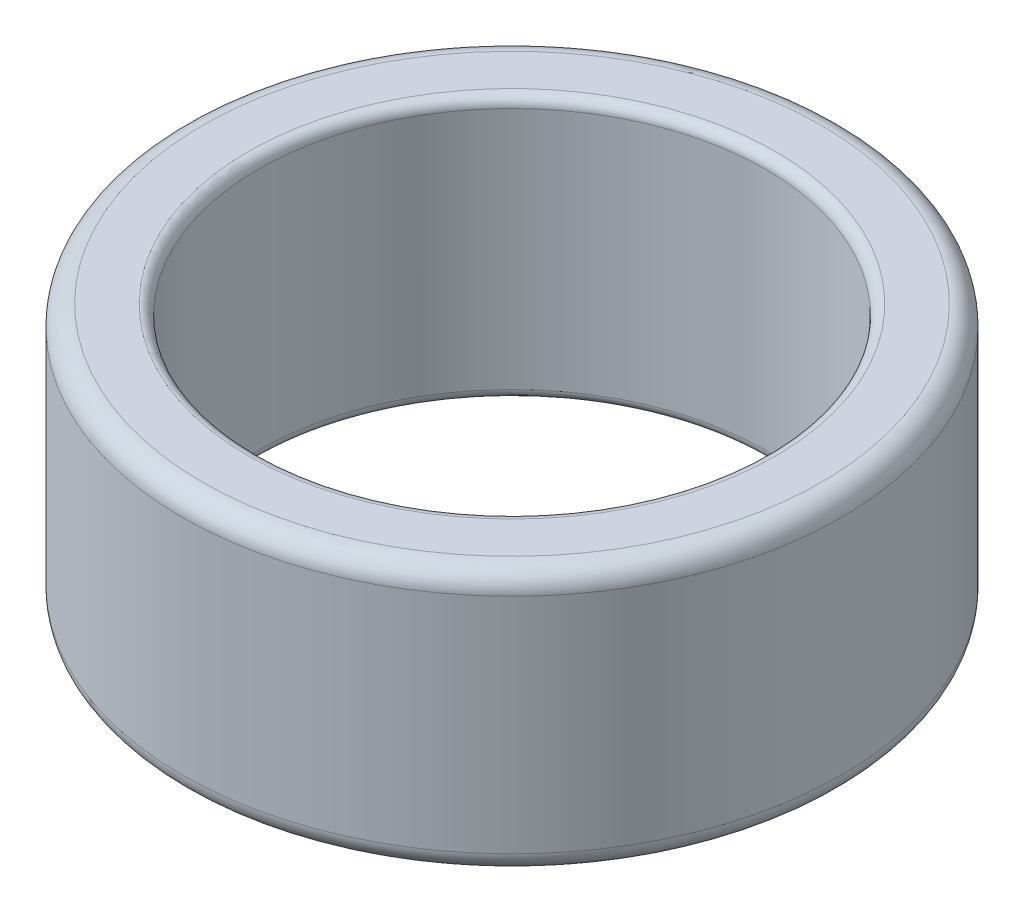
from build123d import *

# Parameters (mm, degrees)
SKETCH_1_R      = 32.5
SKETCH_1_R_2    = 25
EXTRUDE_1_DEPTH = 26
FILLET_1_R      = 2
FILLET_2_R      = 1
EXTRUDE_2_DEPTH = 0.1


with BuildPart() as part:
    # Эскиз1 → Бобышка-Вытянуть1 (new body)
    with BuildSketch(Plane(origin=(0, 0, 0), x_dir=(1, 0, 0), z_dir=(0, 1, 0))):
        with Locations(Location((0, 0, 0), (0, 0, 90))):
            Circle(SKETCH_1_R)
        with Locations(Location((0, 0, 0), (0, 0, 90))):
            Circle(SKETCH_1_R_2, mode=Mode.SUBTRACT)
    extrude(amount=EXTRUDE_1_DEPTH)

    # Скругление1
    fillet_1_edges = [part.edges().sort_by_distance(p)[0] for p in [
        (0, 0, 32.5),
        (0, 26, 32.5),
    ]]
    fillet(fillet_1_edges, radius=FILLET_1_R)

    # Скругление2
    fillet_2_edges = [part.edges().sort_by_distance(p)[0] for p in [
        (0, 0, 25),
        (0, 26, 25),
    ]]
    fillet(fillet_2_edges, radius=FILLET_2_R)

    # Эскиз2 → Бобышка-Вытянуть2 (add)
    # profile 1 of 21: a face of its own
    with BuildSketch(Plane.XZ):
        with BuildLine():
            Line((2.441189236, 26.546875), (2.163953993, 25.890625))
            Line((2.163953993, 25.890625), (0.113172743, 25.993923611))
            Line((0.113172743, 25.993923611), (0.117730035, 26.088867188))
            add(Edge.make_bspline(
                [(0.117730035, 26.088867188), (0.193895344, 26.152166685), (0.341574527, 26.274899962), (0.55241666, 26.457070508), (0.746503286, 26.630120214), (0.922986454, 26.794771482), (1.081653467, 26.951418338), (1.224274021, 27.098351891), (1.349096464, 27.23753175), (1.458251487, 27.368962363), (1.552547496, 27.495233163), (1.634491729, 27.618032044), (1.704705627, 27.738578714), (1.762463312, 27.857289225), (1.809550098, 27.973352845), (1.844712876, 28.087360489), (1.868311417, 28.199553306), (1.874543584, 28.273990956), (1.877604167, 28.310546875)],
                knots=[0, 0, 0, 0, 1.637624356, 3.175238526, 4.607349881, 5.937316414, 7.165919496, 8.294026821, 9.32282856, 10.25663092, 11.11824814, 11.927583851, 12.696664475, 13.423166711, 14.108871243, 14.765735901, 15.393859709, 16, 16, 16, 16], degree=3))
            add(Edge.make_bspline(
                [(1.877604167, 28.310546875), (1.878276432, 28.337637846), (1.879591028, 28.390613467), (1.874456956, 28.468472157), (1.861813824, 28.542806904), (1.84438843, 28.614451534), (1.817801053, 28.68189813), (1.786793669, 28.746610863), (1.748418166, 28.807605139), (1.704060343, 28.864785917), (1.654738307, 28.916634498), (1.603142213, 28.963845172), (1.547523475, 29.003136428), (1.48922107, 29.036141834), (1.428472535, 29.06291054), (1.364479498, 29.082658098), (1.297857878, 29.096716541), (1.25205567, 29.100226065), (1.228949653, 29.101996528)],
                knots=[0, 0, 0, 0, 1.13946347, 2.228188327, 3.2750724, 4.308163506, 5.322702704, 6.318059603, 7.32265843, 8.347207575, 9.356648413, 10.329419903, 11.283833344, 12.21369339, 13.143553436, 14.06974779, 15.026238174, 16, 16, 16, 16], degree=3))
            add(Edge.make_bspline(
                [(1.228949653, 29.101996528), (1.187083974, 29.10237597), (1.104720487, 29.103122456), (0.983164112, 29.080073359), (0.867792791, 29.03769951), (0.758341792, 28.977538842), (0.658067389, 28.898258835), (0.571014268, 28.798793095), (0.494509602, 28.682573873), (0.45692906, 28.595052864), (0.4375, 28.549804688)],
                knots=[0, 0, 0, 0, 0.968728485, 1.905805887, 2.849039177, 3.807920444, 4.78964831, 5.795691076, 6.860376957, 8, 8, 8, 8], degree=3))
            Line((0.4375, 28.549804688), (0.342556424, 28.555121528))
            add(Edge.make_bspline(
                [(0.342556424, 28.555121528), (0.350395534, 28.593219493), (0.365729383, 28.667741784), (0.396881075, 28.774930326), (0.434434855, 28.87473074), (0.476346221, 28.96808066), (0.526340131, 29.053235965), (0.580821589, 29.131777271), (0.641270455, 29.203371378), (0.708146873, 29.266743413), (0.779419801, 29.323235128), (0.855228002, 29.371162426), (0.9340206, 29.411822258), (1.01724472, 29.44308277), (1.103768039, 29.466363129), (1.194149764, 29.482874525), (1.288362973, 29.489337009), (1.352248691, 29.487844702), (1.384657118, 29.487087674)],
                knots=[0, 0, 0, 0, 1.208797493, 2.364492685, 3.46528506, 4.521801305, 5.540984767, 6.530064045, 7.490450739, 8.447930589, 9.389492647, 10.313054009, 11.231739888, 12.140937057, 13.070748367, 14.014052204, 14.992553463, 16, 16, 16, 16], degree=3))
            add(Edge.make_bspline(
                [(1.384657118, 29.487087674), (1.419145416, 29.484328751), (1.486960542, 29.478903819), (1.586109394, 29.461780247), (1.680103303, 29.434404475), (1.769838776, 29.400995026), (1.854276777, 29.357551907), (1.933942049, 29.306800586), (2.009285998, 29.247820987), (2.078152482, 29.180584715), (2.140729238, 29.108455036), (2.195023126, 29.033012645), (2.240352456, 28.955044967), (2.276381683, 28.874082166), (2.302696838, 28.790136194), (2.321478792, 28.704034651), (2.329714032, 28.615030539), (2.328587862, 28.555130313), (2.328016493, 28.524739583)],
                knots=[0, 0, 0, 0, 1.107674149, 2.178044961, 3.214880845, 4.238797842, 5.23956606, 6.249423144, 7.259898425, 8.297716538, 9.326628905, 10.314372533, 11.269741137, 12.209850604, 13.145755311, 14.082362123, 15.027075211, 16, 16, 16, 16], degree=3))
            add(Edge.make_bspline(
                [(2.328016493, 28.524739583), (2.324224747, 28.480793956), (2.316569332, 28.392069125), (2.286083081, 28.260273021), (2.240170224, 28.129313862), (2.199244115, 28.045094163), (2.178385417, 28.002170139)],
                knots=[0, 0, 0, 0, 0.965590312, 1.949496264, 2.954925361, 4, 4, 4, 4], degree=3))
            add(Edge.make_bspline(
                [(2.178385417, 28.002170139), (2.160041951, 27.968017941), (2.122479933, 27.898084295), (2.057461836, 27.795425834), (1.985767045, 27.691235922), (1.907785374, 27.5851899), (1.820592381, 27.479368148), (1.727428729, 27.371234019), (1.626095983, 27.262524396), (1.554755561, 27.191017009), (1.518337674, 27.154513889)],
                knots=[0, 0, 0, 0, 0.862424112, 1.765990642, 2.702064435, 3.6767613, 4.693942596, 5.752368594, 6.852628198, 8, 8, 8, 8], degree=3))
            add(Edge.make_bspline(
                [(1.518337674, 27.154513889), (1.491035291, 27.127381305), (1.437826427, 27.074503357), (1.359291283, 26.997842371), (1.285201155, 26.924824067), (1.214293666, 26.856748584), (1.148218695, 26.791920586), (1.086109444, 26.731231366), (1.027725708, 26.674912945), (0.972462779, 26.623363591), (0.922489302, 26.574810075), (0.875192969, 26.531513065), (0.83363945, 26.490957967), (0.793991294, 26.456523922), (0.760388612, 26.423941049), (0.729261812, 26.397132026), (0.702500011, 26.374002777), (0.685893179, 26.360254791), (0.67827691, 26.353949653)],
                knots=[0, 0, 0, 0, 1.591826571, 3.102267099, 4.538673724, 5.893744662, 7.167278231, 8.36677947, 9.484968519, 10.521918525, 11.49206596, 12.366211969, 13.173527894, 13.892646504, 14.537156849, 15.108447356, 15.591113745, 16, 16, 16, 16], degree=3))
            Line((0.67827691, 26.353949653), (1.5859375, 26.307617188))
            add(Edge.make_bspline(
                [(1.5859375, 26.307617188), (1.628714104, 26.30562615), (1.707405951, 26.301963436), (1.815095059, 26.299993217), (1.902202567, 26.302409378), (1.972051104, 26.306358244), (2.030244758, 26.318490518), (2.083461627, 26.332613659), (2.133233334, 26.355107569), (2.181812507, 26.380450263), (2.227583776, 26.413405209), (2.269960334, 26.45355756), (2.311109222, 26.499153196), (2.33428197, 26.534132585), (2.34624566, 26.55219184)],
                knots=[0, 0, 0, 0, 1.815949425, 3.340620765, 4.564955014, 5.512712358, 6.300185877, 7.081782645, 7.841619467, 8.610204203, 9.402711417, 10.223159763, 11.082648037, 12, 12, 12, 12], degree=3))
            Line((2.34624566, 26.55219184), (2.441189236, 26.546875))
        make_face()
    # profile 2 of 21: a face of its own
    with BuildSketch(Plane.XZ):
        with BuildLine():
            Line((5.489927402, 29.025899804), (5.475495979, 28.931715776))
            add(Edge.make_bspline(
                [(5.475495979, 28.931715776), (5.421065876, 28.933773875), (5.316724086, 28.937719223), (5.166890191, 28.930846612), (5.030954112, 28.914301853), (4.906853776, 28.884987737), (4.789828612, 28.842013707), (4.67361836, 28.788085753), (4.556113788, 28.720560066), (4.439252153, 28.640848209), (4.325616942, 28.55119534), (4.217707582, 28.453761209), (4.118471704, 28.34809295), (4.026168314, 28.23446548), (3.940585556, 28.110392705), (3.858389999, 27.975246178), (3.781203175, 27.826638215), (3.733869863, 27.722237536), (3.709545458, 27.668586436)],
                knots=[0, 0, 0, 0, 1.120619907, 2.148213615, 3.0834428, 3.935289257, 4.766011934, 5.644920303, 6.569154054, 7.551934725, 8.553732808, 9.54604038, 10.541312375, 11.534153377, 12.556116755, 13.64100998, 14.787724245, 16, 16, 16, 16], degree=3))
            add(Edge.make_bspline(
                [(3.709545458, 27.668586436), (3.742780309, 27.683955498), (3.808164739, 27.71419175), (3.907629809, 27.751347773), (4.00614224, 27.780436005), (4.103366311, 27.801682291), (4.199543338, 27.81586518), (4.29458293, 27.820842676), (4.388625736, 27.819093751), (4.450402131, 27.811416869), (4.481246847, 27.807583831)],
                knots=[0, 0, 0, 0, 1.103539192, 2.171042681, 3.19745518, 4.197507054, 5.168956451, 6.124504647, 7.063572398, 8, 8, 8, 8], degree=3))
            add(Edge.make_bspline(
                [(4.481246847, 27.807583831), (4.510027497, 27.802462929), (4.567142744, 27.79230049), (4.649078083, 27.764847515), (4.72760795, 27.730829514), (4.801353675, 27.687178054), (4.870852418, 27.635216558), (4.935729769, 27.574812945), (4.995790536, 27.505752115), (5.051681881, 27.429833127), (5.100880297, 27.347230593), (5.142120821, 27.260156108), (5.173214374, 27.168782915), (5.19605597, 27.073963646), (5.210837505, 26.975346635), (5.214612188, 26.872597295), (5.211452759, 26.76635165), (5.201701336, 26.694785985), (5.196741639, 26.658386783)],
                knots=[0, 0, 0, 0, 0.929296907, 1.844191244, 2.742611264, 3.649270047, 4.564732068, 5.499880678, 6.464933412, 7.473937222, 8.496653515, 9.520480439, 10.53478022, 11.562879768, 12.621631914, 13.702570571, 14.831498351, 16, 16, 16, 16], degree=3))
            add(Edge.make_bspline(
                [(5.196741639, 26.658386783), (5.190458977, 26.62282523), (5.178008276, 26.552350912), (5.149735425, 26.449349178), (5.112877223, 26.35059979), (5.069573092, 26.254834729), (5.01789895, 26.162711116), (4.957388907, 26.074931222), (4.890770434, 25.989575693), (4.840248425, 25.937391572), (4.814688687, 25.91099095)],
                knots=[0, 0, 0, 0, 1.014481265, 2.010454288, 2.996465542, 3.973968316, 4.961544322, 5.960131685, 6.968004207, 8, 8, 8, 8], degree=3))
            add(Edge.make_bspline(
                [(4.814688687, 25.91099095), (4.782995127, 25.880524755), (4.721068627, 25.820996423), (4.617888388, 25.747604093), (4.51215709, 25.686197987), (4.400692742, 25.641565975), (4.285608416, 25.609611832), (4.165795997, 25.594446302), (4.041821839, 25.591125651), (3.958608299, 25.601749786), (3.91614268, 25.607171505)],
                knots=[0, 0, 0, 0, 1.067153271, 2.085126012, 3.068991752, 4.032320759, 4.99517793, 5.963818786, 6.960893935, 8, 8, 8, 8], degree=3))
            add(Edge.make_bspline(
                [(3.91614268, 25.607171505), (3.887419256, 25.612223966), (3.830661203, 25.622207729), (3.748767773, 25.645917046), (3.670989451, 25.676330498), (3.598577249, 25.714780679), (3.529128061, 25.757833838), (3.465419792, 25.809314512), (3.405559901, 25.867028492), (3.370357778, 25.910351678), (3.352557611, 25.932258311)],
                knots=[0, 0, 0, 0, 1.048187459, 2.071239095, 3.060341517, 4.045875359, 5.015850622, 5.994165884, 6.985737771, 8, 8, 8, 8], degree=3))
            add(Edge.make_bspline(
                [(3.352557611, 25.932258311), (3.319904564, 25.976664112), (3.255259831, 26.064576314), (3.176548291, 26.207144265), (3.112478701, 26.354874895), (3.067187103, 26.509608362), (3.037360535, 26.670193886), (3.023972075, 26.836848581), (3.026562731, 27.00968338), (3.041749554, 27.125609603), (3.049497715, 27.18475397)],
                knots=[0, 0, 0, 0, 0.995940044, 1.971708164, 2.937899801, 3.902777697, 4.880788632, 5.886949513, 6.921943346, 8, 8, 8, 8], degree=3))
            add(Edge.make_bspline(
                [(3.049497715, 27.18475397), (3.055979088, 27.222798006), (3.068918215, 27.298747431), (3.094565399, 27.410950224), (3.126953372, 27.520782547), (3.163886302, 27.628372938), (3.206460654, 27.733733677), (3.255538555, 27.83635638), (3.309091903, 27.937224494), (3.368432767, 28.035357209), (3.433211977, 28.130143185), (3.501855012, 28.222100822), (3.576200468, 28.309595601), (3.654191735, 28.394063888), (3.73715982, 28.474333668), (3.823922003, 28.551637289), (3.915898954, 28.624428427), (4.011755497, 28.692535644), (4.107937861, 28.756920118), (4.203935113, 28.814613974), (4.297790426, 28.866352721), (4.38975163, 28.911363089), (4.479616662, 28.949372876), (4.567260424, 28.981511207), (4.653089634, 29.007790228), (4.764039682, 29.032151718), (4.897872979, 29.052061849), (5.052868227, 29.066292521), (5.200712631, 29.065048876), (5.296053493, 29.054052119), (5.342574972, 29.048686262)],
                knots=[0, 0, 0, 0, 0.996580356, 1.98952884, 2.970346607, 3.95258009, 4.926398177, 5.903306679, 6.889124769, 7.874834426, 8.863251338, 9.853224268, 10.836958358, 11.827104028, 12.821278946, 13.817172627, 14.827134503, 15.84873467, 16.853433419, 17.815590709, 18.740314569, 19.6205526, 20.458538157, 21.259078818, 22.030683168, 22.774669345, 24.190508849, 25.522528551, 26.791120273, 28, 28, 28, 28], degree=3))
            Line((5.342574972, 29.048686262), (5.489927402, 29.025899804))
        make_face()
        with BuildLine():
            add(Edge.make_bspline(
                [(3.63738834, 27.489332963), (3.622115853, 27.436253528), (3.593122509, 27.33548734), (3.557073755, 27.190966331), (3.527018487, 27.06235337), (3.51369679, 26.981018098), (3.507505527, 26.943217512)],
                knots=[0, 0, 0, 0, 1.179807358, 2.23975045, 3.181923619, 4, 4, 4, 4], degree=3))
            add(Edge.make_bspline(
                [(3.507505527, 26.943217512), (3.502170124, 26.901503551), (3.491240002, 26.81604821), (3.489492468, 26.683106314), (3.495946423, 26.543224332), (3.514104377, 26.399760866), (3.541894608, 26.258473566), (3.585378857, 26.127478341), (3.640906167, 26.008401701), (3.690015728, 25.938969388), (3.71410275, 25.904914561)],
                knots=[0, 0, 0, 0, 0.930337101, 1.905891283, 2.93847232, 4.028598801, 5.104802648, 6.120449447, 7.078127084, 8, 8, 8, 8], degree=3))
            add(Edge.make_bspline(
                [(3.71410275, 25.904914561), (3.733587158, 25.883316129), (3.771993338, 25.840742946), (3.843239733, 25.79140677), (3.923394596, 25.75549096), (3.981390137, 25.743800081), (4.011086257, 25.737813866)],
                knots=[0, 0, 0, 0, 0.998643808, 1.968450549, 2.95976252, 4, 4, 4, 4], degree=3))
            add(Edge.make_bspline(
                [(4.011086257, 25.737813866), (4.029285343, 25.735561837), (4.065605098, 25.731067483), (4.120538331, 25.732921378), (4.175090969, 25.741385558), (4.229198384, 25.756615369), (4.282434198, 25.779080817), (4.335655785, 25.807332083), (4.387562131, 25.843405012), (4.439384852, 25.884955702), (4.48861765, 25.933037001), (4.532921988, 25.98871542), (4.573326202, 26.05037954), (4.608817836, 26.118621188), (4.639107211, 26.193318326), (4.666025871, 26.273812669), (4.686789941, 26.361399775), (4.697520524, 26.422109517), (4.703035041, 26.453308658)],
                knots=[0, 0, 0, 0, 0.794373358, 1.585323824, 2.374289851, 3.184296652, 4.016334489, 4.87609905, 5.792880235, 6.753279088, 7.754977681, 8.770247695, 9.833213021, 10.948168619, 12.100356329, 13.326173641, 14.625902824, 16, 16, 16, 16], degree=3))
            add(Edge.make_bspline(
                [(4.703035041, 26.453308658), (4.7080278, 26.488961116), (4.717845429, 26.559067164), (4.724897271, 26.663586432), (4.727980737, 26.765272777), (4.722765813, 26.864155579), (4.713667972, 26.960206696), (4.696279605, 27.053155541), (4.674624585, 27.143622329), (4.64694808, 27.230414134), (4.613222391, 27.311149696), (4.573969277, 27.384393233), (4.527252707, 27.447876025), (4.474798673, 27.502321308), (4.415808153, 27.547247424), (4.351175711, 27.582998749), (4.27998005, 27.609552128), (4.229773611, 27.61895054), (4.204011604, 27.623773068)],
                knots=[0, 0, 0, 0, 1.223947134, 2.406737217, 3.560846258, 4.68141539, 5.772109815, 6.839545969, 7.894194648, 8.93440316, 9.933900181, 10.866432142, 11.753365367, 12.605857896, 13.429059732, 14.265396458, 15.109937517, 16, 16, 16, 16], degree=3))
            add(Edge.make_bspline(
                [(4.204011604, 27.623773068), (4.170076269, 27.62684291), (4.098654805, 27.633303806), (4.004692744, 27.619096055), (3.918895224, 27.597401124), (3.838402717, 27.569746726), (3.742341218, 27.534342961), (3.674215196, 27.505126496), (3.63738834, 27.489332963)],
                knots=[0, 0, 0, 0, 1.036848228, 2.182186189, 2.875607966, 3.738179407, 4.777328549, 6, 6, 6, 6], degree=3))
        make_face(mode=Mode.SUBTRACT)
    # profile 3 of 21: a face of its own
    with BuildSketch(Plane.XZ):
        with BuildLine():
            add(Edge.make_bspline(
                [(5.829035153, 27.093664102), (5.841851276, 27.140856405), (5.867070213, 27.233719096), (5.91024241, 27.368935528), (5.958186283, 27.49768072), (6.010468123, 27.619833771), (6.066903392, 27.735582526), (6.126522127, 27.845271787), (6.191451666, 27.947926434), (6.259663225, 28.044254811), (6.330533635, 28.133886994), (6.404866449, 28.215072205), (6.479449697, 28.290212096), (6.557568301, 28.355802977), (6.635825506, 28.4161469), (6.716997844, 28.46755642), (6.800202531, 28.511273583), (6.857273804, 28.534945222), (6.885567271, 28.546680595)],
                knots=[0, 0, 0, 0, 1.259923062, 2.479214576, 3.655822154, 4.798520088, 5.901380942, 6.972866781, 8.013585827, 9.029033046, 10.013215772, 10.955378547, 11.864132751, 12.738713466, 13.58157611, 14.408638138, 15.211071679, 16, 16, 16, 16], degree=3))
            add(Edge.make_bspline(
                [(6.885567271, 28.546680595), (6.928987765, 28.562035011), (7.013107608, 28.591781588), (7.14273072, 28.611800357), (7.269201977, 28.613449165), (7.350322757, 28.596757264), (7.390667097, 28.588455769)],
                knots=[0, 0, 0, 0, 1.071065908, 2.075008576, 3.042631113, 4, 4, 4, 4], degree=3))
            add(Edge.make_bspline(
                [(7.390667097, 28.588455769), (7.42236876, 28.578904138), (7.485555752, 28.559866056), (7.574831609, 28.516498999), (7.65864755, 28.462038261), (7.736527417, 28.395177729), (7.808748377, 28.316541723), (7.874870237, 28.226211892), (7.935383355, 28.124433586), (7.969354647, 28.050783878), (7.986912757, 28.012717922)],
                knots=[0, 0, 0, 0, 0.923503276, 1.840704556, 2.760545975, 3.708522107, 4.69933468, 5.735992994, 6.829844742, 8, 8, 8, 8], degree=3))
            add(Edge.make_bspline(
                [(7.986912757, 28.012717922), (8.006946541, 27.962442014), (8.047364734, 27.861010288), (8.089328673, 27.700425259), (8.116439998, 27.532316543), (8.129654051, 27.35668273), (8.125452848, 27.173309871), (8.108829186, 26.9821816), (8.077105125, 26.783086434), (8.044573229, 26.649379529), (8.027928382, 26.58096879)],
                knots=[0, 0, 0, 0, 0.88961502, 1.794799763, 2.723255888, 3.6879409, 4.68764672, 5.73703505, 6.842160734, 8, 8, 8, 8], degree=3))
            add(Edge.make_bspline(
                [(8.027928382, 26.58096879), (8.014815326, 26.533030108), (7.989088987, 26.438979818), (7.945989248, 26.301905289), (7.898207867, 26.172178893), (7.846296646, 26.049344877), (7.791040517, 25.933137072), (7.732044124, 25.823661079), (7.668572887, 25.721408782), (7.602085325, 25.626108843), (7.533181494, 25.53805492), (7.462389099, 25.457906299), (7.390165065, 25.386111712), (7.317941823, 25.320429036), (7.24346926, 25.264102359), (7.168987096, 25.213801909), (7.092523694, 25.172684271), (7.015299143, 25.139481074), (6.938591827, 25.113350456), (6.863979611, 25.091516656), (6.791332219, 25.076387941), (6.720730953, 25.067151958), (6.652181094, 25.063328576), (6.585590509, 25.06452668), (6.520990066, 25.0721323), (6.47939402, 25.081511292), (6.458700952, 25.086177123)],
                knots=[0, 0, 0, 0, 1.496438895, 2.9358444, 4.325137635, 5.657522062, 6.949894697, 8.198395626, 9.400048374, 10.57170251, 11.695684328, 12.764999716, 13.789231117, 14.761051863, 15.701847244, 16.598356694, 17.464766784, 18.311637398, 19.126541667, 19.903549602, 20.651127943, 21.358439269, 22.045620309, 22.716669395, 23.361572769, 24, 24, 24, 24], degree=3))
            add(Edge.make_bspline(
                [(6.458700952, 25.086177123), (6.419450785, 25.098043399), (6.341737699, 25.121537947), (6.234529016, 25.17953269), (6.136305178, 25.252282361), (6.049613723, 25.343560374), (5.971604706, 25.450286821), (5.903401627, 25.57325851), (5.845332918, 25.713037368), (5.816146105, 25.813240809), (5.800931854, 25.865473998)],
                knots=[0, 0, 0, 0, 0.915898122, 1.813425933, 2.712348559, 3.642291521, 4.6194831, 5.664906752, 6.782782629, 8, 8, 8, 8], degree=3))
            add(Edge.make_bspline(
                [(5.800931854, 25.865473998), (5.789518255, 25.911901665), (5.766550136, 26.005330223), (5.746144051, 26.14952718), (5.734583459, 26.297428902), (5.733244788, 26.449176384), (5.741804238, 26.604913127), (5.760119269, 26.764718609), (5.788836064, 26.928571792), (5.815505313, 27.03809885), (5.829035153, 27.093664102)],
                knots=[0, 0, 0, 0, 0.923349994, 1.858100199, 2.810053038, 3.788576182, 4.788069759, 5.822155463, 6.895136215, 8, 8, 8, 8], degree=3))
        make_face()
        with BuildLine():
            add(Edge.make_bspline(
                [(6.301474389, 26.905296047), (6.287437228, 26.848414641), (6.259955751, 26.73705416), (6.225885241, 26.572659569), (6.198920091, 26.41486486), (6.179823198, 26.263579868), (6.168146746, 26.118594134), (6.164597289, 25.980191798), (6.166659614, 25.84850846), (6.175081501, 25.763405774), (6.179187063, 25.721919311)],
                knots=[0, 0, 0, 0, 1.175454053, 2.301263975, 3.367746276, 4.386609399, 5.359874047, 6.284780127, 7.163852391, 8, 8, 8, 8], degree=3))
            add(Edge.make_bspline(
                [(6.179187063, 25.721919311), (6.183672135, 25.689668002), (6.192260827, 25.627908338), (6.213756422, 25.540665942), (6.244258341, 25.46414689), (6.281496491, 25.397962677), (6.325880041, 25.341567689), (6.379417132, 25.297449275), (6.439384786, 25.261781367), (6.483900202, 25.248091385), (6.506552514, 25.24112504)],
                knots=[0, 0, 0, 0, 1.256095991, 2.405361862, 3.457635122, 4.424678808, 5.327978363, 6.208644352, 7.088442797, 8, 8, 8, 8], degree=3))
            add(Edge.make_bspline(
                [(6.506552514, 25.24112504), (6.529765384, 25.236852802), (6.577757, 25.228020135), (6.654375821, 25.233874041), (6.734934312, 25.254856358), (6.820595407, 25.28870275), (6.908203309, 25.342099124), (6.9909136, 25.420358582), (7.07082123, 25.519818886), (7.116470839, 25.597180234), (7.140775604, 25.638368963)],
                knots=[0, 0, 0, 0, 0.703195451, 1.453826488, 2.272492333, 3.185995492, 4.198444519, 5.31795655, 6.572026391, 8, 8, 8, 8], degree=3))
            add(Edge.make_bspline(
                [(7.140775604, 25.638368963), (7.159869573, 25.67337721), (7.199738027, 25.746474882), (7.254630294, 25.864288605), (7.30855249, 25.994231398), (7.362025747, 26.13565473), (7.415552774, 26.289028976), (7.46744525, 26.454326628), (7.519356535, 26.631526848), (7.551726886, 26.754066098), (7.568401472, 26.817188408)],
                knots=[0, 0, 0, 0, 0.761126383, 1.589241762, 2.479712233, 3.446523006, 4.47527597, 5.580488402, 6.753663334, 8, 8, 8, 8], degree=3))
            add(Edge.make_bspline(
                [(7.568401472, 26.817188408), (7.580296792, 26.86447267), (7.603568681, 26.956979143), (7.633558965, 27.093909767), (7.656634295, 27.226062774), (7.676113448, 27.35311147), (7.689786827, 27.475247568), (7.698199642, 27.592303011), (7.701709875, 27.704342865), (7.699410123, 27.777260163), (7.698284285, 27.812956637)],
                knots=[0, 0, 0, 0, 1.161107973, 2.271580425, 3.337214562, 4.35534293, 5.332122921, 6.263014847, 7.149663429, 8, 8, 8, 8], degree=3))
            add(Edge.make_bspline(
                [(7.698284285, 27.812956637), (7.696769138, 27.838043101), (7.693839478, 27.886549813), (7.685381042, 27.956774149), (7.674106045, 28.022216511), (7.65980886, 28.083153124), (7.642317335, 28.13915996), (7.622756579, 28.190756879), (7.59949857, 28.237235476), (7.580599312, 28.265069837), (7.571439667, 28.278559936)],
                knots=[0, 0, 0, 0, 1.233723724, 2.385504832, 3.470694829, 4.49282279, 5.456111137, 6.349488541, 7.200069205, 8, 8, 8, 8], degree=3))
            add(Edge.make_bspline(
                [(7.571439667, 28.278559936), (7.557114542, 28.295892149), (7.528611277, 28.330378736), (7.474561074, 28.371312581), (7.414080447, 28.405351856), (7.368996355, 28.418436296), (7.345853729, 28.425152818)],
                knots=[0, 0, 0, 0, 0.981020644, 1.9519754, 2.948705293, 4, 4, 4, 4], degree=3))
            add(Edge.make_bspline(
                [(7.345853729, 28.425152818), (7.31759305, 28.430700719), (7.261469703, 28.441718389), (7.173831703, 28.431472568), (7.08673571, 28.402400664), (7.033330464, 28.368891298), (7.005575952, 28.351476602)],
                knots=[0, 0, 0, 0, 0.95697383, 1.900470073, 2.908881956, 4, 4, 4, 4], degree=3))
            add(Edge.make_bspline(
                [(7.005575952, 28.351476602), (6.985948117, 28.337255898), (6.945556051, 28.307991149), (6.890773038, 28.253717973), (6.836435701, 28.192813998), (6.783881645, 28.123204475), (6.733497453, 28.044936096), (6.683994848, 27.958781695), (6.636053211, 27.864597071), (6.576259765, 27.727844216), (6.506634386, 27.551117906), (6.428607898, 27.3371701), (6.360026639, 27.121999053), (6.320943738, 26.977352483), (6.301474389, 26.905296047)],
                knots=[0, 0, 0, 0, 0.533082519, 1.097029054, 1.693450617, 2.330236521, 3.015379252, 3.742270015, 4.517812708, 5.341568479, 7.028291437, 8.700416709, 10.356295534, 12, 12, 12, 12], degree=3))
        make_face(mode=Mode.SUBTRACT)
    # profile 4 of 21: a face of its own
    with BuildSketch(Plane.XZ):
        Polygon((10.32881557, 27.781611195), (7.930920605, 24.680374216), (7.737235709, 24.747214494), (10.135130674, 27.848451473), align=None)
    # profile 5 of 21: a face of its own
    with BuildSketch(Plane.XZ):
        Polygon((11.881166293, 24.545227202), (11.736092508, 24.211785362), (11.30846664, 24.397874772), (10.942364209, 23.556294911), (10.554994418, 23.724155154), (10.921096848, 24.565735015), (9.572138515, 25.152866091), (9.702780876, 25.453647341), (12.099156744, 26.920335709), (12.357403272, 26.808682064), (11.453540425, 24.731316612), align=None)
        Polygon((11.066170633, 24.899176855), (11.754321675, 26.480557064), (9.947355529, 25.386047515), align=None, mode=Mode.SUBTRACT)
    # profile 6 of 21: a face of its own
    with BuildSketch(Plane.XZ):
        with BuildLine():
            add(Edge.make_bspline(
                [(12.539764844, 24.701842058), (12.563966793, 24.74408321), (12.611494183, 24.827035689), (12.68759441, 24.945617183), (12.766303161, 25.056814051), (12.846086784, 25.161618679), (12.929411462, 25.258616226), (13.015035069, 25.347932912), (13.102703212, 25.430703147), (13.192785475, 25.505416592), (13.28386283, 25.573048875), (13.375083632, 25.633278515), (13.466368289, 25.6858513), (13.557310453, 25.73086078), (13.648256409, 25.767563326), (13.738878871, 25.79650064), (13.829490902, 25.81833731), (13.890405141, 25.826487867), (13.920624219, 25.830531294)],
                knots=[0, 0, 0, 0, 1.26353364, 2.481306537, 3.655546635, 4.799134108, 5.899020954, 6.97273874, 8.009539191, 9.026848423, 10.008705507, 10.952889907, 11.862594818, 12.741389369, 13.58467038, 14.405632919, 15.209046953, 16, 16, 16, 16], degree=3))
            add(Edge.make_bspline(
                [(13.920624219, 25.830531294), (13.966188104, 25.834202647), (14.054920795, 25.841352367), (14.184827126, 25.828636259), (14.307030292, 25.798266559), (14.380675107, 25.762008509), (14.41736901, 25.743942752)],
                knots=[0, 0, 0, 0, 1.068984306, 2.081777104, 3.044235717, 4, 4, 4, 4], degree=3))
            add(Edge.make_bspline(
                [(14.41736901, 25.743942752), (14.445436264, 25.726652923), (14.501212712, 25.692293835), (14.576592923, 25.628499136), (14.641734689, 25.553689898), (14.700577502, 25.470563092), (14.748344835, 25.37612663), (14.790074845, 25.273003943), (14.821613854, 25.159502027), (14.83554876, 25.07998271), (14.842716233, 25.039081641)],
                knots=[0, 0, 0, 0, 0.926000153, 1.840187155, 2.762980537, 3.708877152, 4.695879958, 5.730898133, 6.832878683, 8, 8, 8, 8], degree=3))
            add(Edge.make_bspline(
                [(14.842716233, 25.039081641), (14.849713209, 24.98575338), (14.863797898, 24.878405293), (14.863518593, 24.713556408), (14.847019582, 24.545674199), (14.816074543, 24.373377829), (14.766443922, 24.198272318), (14.70243319, 24.018941516), (14.621794526, 23.836092393), (14.556965792, 23.716024569), (14.523705816, 23.654424523)],
                knots=[0, 0, 0, 0, 0.890868365, 1.793289582, 2.725062968, 3.684998118, 4.691089927, 5.738565558, 6.839785209, 8, 8, 8, 8], degree=3))
            add(Edge.make_bspline(
                [(14.523705816, 23.654424523), (14.499266752, 23.611665759), (14.451264546, 23.527680753), (14.374062248, 23.407574819), (14.295615869, 23.294549866), (14.214753616, 23.189584947), (14.132890092, 23.09154857), (14.04738874, 23.002313006), (13.961372746, 22.91917857), (13.872975182, 22.844790735), (13.784292859, 22.778116252), (13.696126185, 22.718682047), (13.609057634, 22.666837112), (13.522372764, 22.62326217), (13.43708875, 22.586628994), (13.352532182, 22.558198875), (13.268807054, 22.538476571), (13.186524654, 22.525381538), (13.10622514, 22.519925331), (13.02914295, 22.517956863), (12.955466282, 22.521541945), (12.885314017, 22.531185153), (12.818292793, 22.543407564), (12.754796338, 22.5619573), (12.694693598, 22.585183983), (12.657075942, 22.604879751), (12.638506163, 22.614602474)],
                knots=[0, 0, 0, 0, 1.492838658, 2.932172357, 4.326853689, 5.662477393, 6.947933145, 8.196657971, 9.40727056, 10.572833779, 11.696526751, 12.769449522, 13.794896306, 14.766323658, 15.7086602, 16.60672548, 17.466825841, 18.313568562, 19.129484477, 19.904861072, 20.65037218, 21.36249895, 22.050430244, 22.713594468, 23.36497195, 24, 24, 24, 24], degree=3))
            add(Edge.make_bspline(
                [(12.638506163, 22.614602474), (12.604053819, 22.635808805), (12.535654731, 22.677910256), (12.446921417, 22.760063158), (12.371487619, 22.855335151), (12.310790374, 22.964674226), (12.262719934, 23.086440932), (12.228825927, 23.2217298), (12.208546583, 23.370249712), (12.205582236, 23.473838753), (12.204044358, 23.527579905)],
                knots=[0, 0, 0, 0, 0.911667525, 1.809955991, 2.713467951, 3.645185821, 4.622874585, 5.661362004, 6.786733618, 8, 8, 8, 8], degree=3))
            add(Edge.make_bspline(
                [(12.204044358, 23.527579905), (12.204819865, 23.575218678), (12.20637896, 23.670992514), (12.222379802, 23.815160082), (12.24808038, 23.960341708), (12.284983328, 24.106663609), (12.332007937, 24.254471205), (12.39112019, 24.402932547), (12.459111532, 24.553530659), (12.512540923, 24.651780657), (12.539764844, 24.701842058)],
                knots=[0, 0, 0, 0, 0.925497902, 1.860637413, 2.815199154, 3.788982231, 4.79109339, 5.827234378, 6.892908971, 8, 8, 8, 8], degree=3))
        make_face()
        with BuildLine():
            add(Edge.make_bspline(
                [(12.946123351, 24.401820356), (12.918201218, 24.350596217), (12.863615213, 24.250456261), (12.789107566, 24.100859584), (12.723593788, 23.95573583), (12.667098606, 23.815164421), (12.620025061, 23.678945901), (12.580768881, 23.54733588), (12.550913579, 23.419965208), (12.537282263, 23.336006303), (12.53065026, 23.29515803)],
                knots=[0, 0, 0, 0, 1.177948913, 2.302815691, 3.373690139, 4.39233035, 5.360778934, 6.282845181, 7.164557847, 8, 8, 8, 8], degree=3))
            add(Edge.make_bspline(
                [(12.53065026, 23.29515803), (12.5266351, 23.263053137), (12.518971613, 23.201776523), (12.519326056, 23.112897552), (12.527307854, 23.031712836), (12.547455014, 22.958857752), (12.57607058, 22.893641134), (12.615885228, 22.837581435), (12.664088299, 22.787940479), (12.703471093, 22.763697181), (12.723575608, 22.751321224)],
                knots=[0, 0, 0, 0, 1.257630666, 2.400361513, 3.451251109, 4.421524707, 5.329753832, 6.207002173, 7.084692898, 8, 8, 8, 8], degree=3))
            add(Edge.make_bspline(
                [(12.723575608, 22.751321224), (12.744759683, 22.741236988), (12.788627334, 22.72035471), (12.864058644, 22.707195061), (12.946928904, 22.706294906), (13.037995104, 22.717279268), (13.135279349, 22.74723072), (13.234872379, 22.800562276), (13.335988666, 22.876595939), (13.399314823, 22.93910516), (13.43299401, 22.97234987)],
                knots=[0, 0, 0, 0, 0.70341554, 1.456621865, 2.279745148, 3.193725172, 4.206094622, 5.32405952, 6.576836115, 8, 8, 8, 8], degree=3))
            add(Edge.make_bspline(
                [(13.43299401, 22.97234987), (13.460160966, 23.001173715), (13.516929653, 23.061404676), (13.598786137, 23.161375237), (13.684376585, 23.271705388), (13.771553225, 23.39424697), (13.86065135, 23.528598395), (13.952937075, 23.673994632), (14.046906816, 23.831160191), (14.108962679, 23.940645596), (14.140893316, 23.996980947)],
                knots=[0, 0, 0, 0, 0.761174575, 1.590567699, 2.482262782, 3.445184243, 4.480495312, 5.580896595, 6.755258402, 8, 8, 8, 8], degree=3))
            add(Edge.make_bspline(
                [(14.140893316, 23.996980947), (14.164173631, 24.039386992), (14.209850163, 24.122588658), (14.272815941, 24.246896139), (14.329026039, 24.367853622), (14.379412269, 24.485036552), (14.423661842, 24.598654914), (14.460728941, 24.709023657), (14.492505257, 24.815559506), (14.508861521, 24.886069127), (14.516869878, 24.920592058)],
                knots=[0, 0, 0, 0, 1.160155081, 2.276251801, 3.341159229, 4.358523655, 5.335058436, 6.264429057, 7.150229485, 8, 8, 8, 8], degree=3))
            add(Edge.make_bspline(
                [(14.516869878, 24.920592058), (14.525405417, 24.968063664), (14.54153125, 25.057749759), (14.550077453, 25.186148353), (14.541798025, 25.300333683), (14.521773922, 25.368444567), (14.512312587, 25.40062678)],
                knots=[0, 0, 0, 0, 1.190920483, 2.24995563, 3.173108662, 4, 4, 4, 4], degree=3))
            add(Edge.make_bspline(
                [(14.512312587, 25.40062678), (14.503238206, 25.420844029), (14.48511035, 25.461231951), (14.443341064, 25.513661565), (14.393276214, 25.560733216), (14.353573901, 25.584875293), (14.333059114, 25.59734987)],
                knots=[0, 0, 0, 0, 0.976423101, 1.950596747, 2.941042308, 4, 4, 4, 4], degree=3))
            add(Edge.make_bspline(
                [(14.333059114, 25.59734987), (14.307171207, 25.609563093), (14.255642883, 25.63387278), (14.168860749, 25.646929718), (14.077294963, 25.640786906), (14.017304716, 25.621738607), (13.985945399, 25.611781294)],
                knots=[0, 0, 0, 0, 0.954094803, 1.899068356, 2.901758497, 4, 4, 4, 4], degree=3))
            add(Edge.make_bspline(
                [(13.985945399, 25.611781294), (13.963716636, 25.602852893), (13.917919209, 25.584457909), (13.851179562, 25.547418947), (13.784080814, 25.502163683), (13.716414964, 25.448712883), (13.648124237, 25.386867757), (13.578722949, 25.31700636), (13.510168564, 25.237613438), (13.417083524, 25.122158571), (13.305926628, 24.969633691), (13.176916379, 24.783780722), (13.056721743, 24.594783088), (12.982856982, 24.465910093), (12.946123351, 24.401820356)],
                knots=[0, 0, 0, 0, 0.531525292, 1.09508972, 1.690747658, 2.327344837, 3.008091555, 3.735613898, 4.512551844, 5.336156169, 7.028465861, 8.701814002, 10.35978149, 12, 12, 12, 12], degree=3))
        make_face(mode=Mode.SUBTRACT)
    # profile 7 of 21: a face of its own
    with BuildSketch(Plane.XZ):
        Polygon((17.08022364, 24.237369569), (13.964555237, 21.840234153), (13.7936568, 21.954166444), (16.909325202, 24.351301861), align=None)
    # profile 8 of 21: a face of its own
    with BuildSketch(Plane.XZ):
        with BuildLine():
            Line((17.468735464, 23.293528588), (18.389308381, 23.093767303))
            Line((18.389308381, 23.093767303), (18.456148658, 23.041358449))
            Line((18.456148658, 23.041358449), (16.638548832, 20.731571123))
            add(Edge.make_bspline(
                [(16.638548832, 20.731571123), (16.624048701, 20.713396737), (16.596474336, 20.678835176), (16.558304731, 20.628818856), (16.526010863, 20.582858835), (16.49699083, 20.543076865), (16.473053625, 20.508094943), (16.454998034, 20.477658382), (16.44095833, 20.452509098), (16.428482572, 20.425717687), (16.421732673, 20.393988272), (16.420798748, 20.356301236), (16.428116678, 20.317962149), (16.443186442, 20.276655569), (16.473234825, 20.231058532), (16.520826354, 20.179944027), (16.584140017, 20.117663786), (16.634389571, 20.075681658), (16.662094839, 20.052534664)],
                knots=[0, 0, 0, 0, 1.331595931, 2.532247006, 3.60263151, 4.548278622, 5.352628791, 6.029040092, 6.574110356, 7.002548897, 7.716613131, 8.412785648, 9.149459765, 9.938635887, 10.916206985, 12.251665936, 13.933342809, 16, 16, 16, 16], degree=3))
            Line((16.662094839, 20.052534664), (16.603609596, 19.9780989))
            Line((16.603609596, 19.9780989), (15.574421228, 20.78777772))
            Line((15.574421228, 20.78777772), (15.632906471, 20.862213484))
            add(Edge.make_bspline(
                [(15.632906471, 20.862213484), (15.66306687, 20.840123647), (15.717764279, 20.80006261), (15.79413108, 20.750467395), (15.85548796, 20.716171808), (15.905504512, 20.69792315), (15.947265479, 20.693481836), (15.98390336, 20.694818828), (16.018335047, 20.701804704), (16.046387907, 20.712613028), (16.069631981, 20.728000474), (16.0907704, 20.746873948), (16.116258437, 20.772043176), (16.14710964, 20.802833922), (16.17980339, 20.842204939), (16.217910472, 20.886891622), (16.260865976, 20.937752008), (16.289792889, 20.974774818), (16.305106992, 20.994374942)],
                knots=[0, 0, 0, 0, 2.120860608, 3.846288006, 5.163700337, 6.104071146, 6.84176946, 7.531916498, 8.177090228, 8.827996117, 9.222461956, 9.752239054, 10.432901671, 11.255763357, 12.223390664, 13.334381885, 14.588803851, 16, 16, 16, 16], degree=3))
            Line((16.305106992, 20.994374942), (17.467216367, 22.470937442))
            add(Edge.make_bspline(
                [(17.467216367, 22.470937442), (17.485719259, 22.494720844), (17.52107554, 22.540167395), (17.571221895, 22.605284664), (17.615458829, 22.664414924), (17.65303798, 22.717795971), (17.686449223, 22.763962693), (17.712536058, 22.80482104), (17.73374597, 22.838909963), (17.744329472, 22.860260471), (17.749008901, 22.869700463)],
                knots=[0, 0, 0, 0, 1.479153183, 2.826442153, 4.034464046, 5.103569937, 6.031109538, 6.830865485, 7.48307455, 8, 8, 8, 8], degree=3))
            add(Edge.make_bspline(
                [(17.749008901, 22.869700463), (17.754398217, 22.88197967), (17.764628491, 22.905288687), (17.77421728, 22.940556653), (17.776665938, 22.973836897), (17.772744632, 23.005004732), (17.763432363, 23.033920192), (17.749923522, 23.061077172), (17.730103115, 23.084951358), (17.714516281, 23.098783382), (17.706474179, 23.105920081)],
                knots=[0, 0, 0, 0, 1.225950015, 2.327160729, 3.325640025, 4.25941642, 5.182500919, 6.094179848, 7.016682876, 8, 8, 8, 8], degree=3))
            add(Edge.make_bspline(
                [(17.706474179, 23.105920081), (17.692087053, 23.1160691), (17.660424807, 23.138404397), (17.601247798, 23.162517215), (17.530266126, 23.187505526), (17.477505093, 23.200121162), (17.4489872, 23.206940046)],
                knots=[0, 0, 0, 0, 0.756481673, 1.664815438, 2.737808157, 4, 4, 4, 4], degree=3))
            Line((17.4489872, 23.206940046), (17.468735464, 23.293528588))
        make_face()
    # profile 9 of 21: a face of its own
    with BuildSketch(Plane.XZ):
        with BuildLine():
            Line((17.251430247, 19.339308137), (17.317510977, 19.407667512))
            add(Edge.make_bspline(
                [(17.317510977, 19.407667512), (17.359019656, 19.371498114), (17.441061922, 19.300008987), (17.576939491, 19.210459287), (17.721318593, 19.139106488), (17.848149883, 19.092725369), (17.954556966, 19.065260902), (18.039707934, 19.051048427), (18.129019463, 19.042079141), (18.222862476, 19.038371967), (18.320984424, 19.040010877), (18.423628614, 19.047026815), (18.53088988, 19.05908961), (18.641348084, 19.07737456), (18.753206779, 19.100561369), (18.863828459, 19.129691465), (18.972911275, 19.16262259), (19.079037512, 19.202635818), (19.18360301, 19.246631193), (19.286025833, 19.296031208), (19.386577285, 19.350536024), (19.451289874, 19.391114775), (19.483743615, 19.411465255)],
                knots=[0, 0, 0, 0, 1.414432372, 2.795637829, 4.169753076, 5.547379538, 6.259447652, 6.992540633, 7.764654526, 8.566016681, 9.405877048, 10.286645836, 11.210413109, 12.180018237, 13.164371058, 14.146461119, 15.120426985, 16.092629108, 17.061097228, 18.036476136, 19.015281317, 20, 20, 20, 20], degree=3))
            add(Edge.make_bspline(
                [(19.483743615, 19.411465255), (19.445687432, 19.419732148), (19.371433482, 19.435862234), (19.264452639, 19.465071828), (19.165239395, 19.499675742), (19.072874304, 19.537335902), (18.987882455, 19.579862144), (18.909890843, 19.626126831), (18.839526829, 19.67683311), (18.79779204, 19.714886989), (18.777363407, 19.733513866)],
                knots=[0, 0, 0, 0, 1.188148907, 2.318276288, 3.380994593, 4.392383753, 5.359710611, 6.277820035, 7.157015421, 8, 8, 8, 8], degree=3))
            add(Edge.make_bspline(
                [(18.777363407, 19.733513866), (18.756429058, 19.755162621), (18.71502858, 19.797975932), (18.661055022, 19.868046055), (18.615253515, 19.942363339), (18.580387583, 20.021756457), (18.551297255, 20.104269549), (18.532813024, 20.191332352), (18.522111355, 20.282364723), (18.520035678, 20.376682441), (18.52615447, 20.472521907), (18.544585594, 20.567460708), (18.570485083, 20.661245262), (18.608754328, 20.752945939), (18.655565308, 20.843459415), (18.713545569, 20.931877262), (18.779904673, 21.019576121), (18.831032554, 21.074301634), (18.857116011, 21.102220463)],
                knots=[0, 0, 0, 0, 0.942782203, 1.864477961, 2.764942788, 3.670110722, 4.575556593, 5.5012023, 6.451527279, 7.443215942, 8.453007655, 9.453254365, 10.467521355, 11.49555626, 12.559789593, 13.655361432, 14.803856553, 16, 16, 16, 16], degree=3))
            add(Edge.make_bspline(
                [(18.857116011, 21.102220463), (18.883818696, 21.128716226), (18.936695259, 21.181183043), (19.02203906, 21.251833842), (19.111432326, 21.314599026), (19.204539303, 21.368966863), (19.301209224, 21.415916657), (19.401515238, 21.454641258), (19.505983173, 21.485310505), (19.577545264, 21.499264704), (19.613626428, 21.506300324)],
                knots=[0, 0, 0, 0, 1.034213534, 2.047946034, 3.04284864, 4.03531132, 5.010125745, 5.995527685, 6.989357462, 8, 8, 8, 8], degree=3))
            add(Edge.make_bspline(
                [(19.613626428, 21.506300324), (19.656817897, 21.51286116), (19.741351489, 21.525701913), (19.867153815, 21.527836866), (19.987565335, 21.515299971), (20.103529991, 21.490874834), (20.213725692, 21.449934355), (20.31913881, 21.396154382), (20.419605773, 21.328455703), (20.479926352, 21.2731752), (20.510653338, 21.245015602)],
                knots=[0, 0, 0, 0, 1.07683932, 2.107571155, 3.093245032, 4.058624478, 5.022871799, 5.983775638, 6.972945908, 8, 8, 8, 8], degree=3))
            add(Edge.make_bspline(
                [(20.510653338, 21.245015602), (20.535288875, 21.219706243), (20.583784419, 21.169884265), (20.645866792, 21.086823735), (20.697064504, 20.998323066), (20.737271315, 20.904084899), (20.768174911, 20.805199762), (20.78657901, 20.700580833), (20.796306313, 20.590955024), (20.793751459, 20.516115915), (20.792445872, 20.477871505)],
                knots=[0, 0, 0, 0, 1.002713891, 1.973862238, 2.937521586, 3.900992962, 4.879440786, 5.874175119, 6.913657312, 8, 8, 8, 8], degree=3))
            add(Edge.make_bspline(
                [(20.792445872, 20.477871505), (20.788308401, 20.430151666), (20.780085057, 20.335307123), (20.751317786, 20.195354193), (20.709448287, 20.059442608), (20.654832727, 19.926850327), (20.58826081, 19.797658562), (20.507432481, 19.672635051), (20.415038361, 19.550448844), (20.344489935, 19.474429504), (20.308613407, 19.43577081)],
                knots=[0, 0, 0, 0, 0.97858309, 1.944961823, 2.91421949, 3.882149483, 4.87297588, 5.880918993, 6.92236759, 8, 8, 8, 8], degree=3))
            add(Edge.make_bspline(
                [(20.308613407, 19.43577081), (20.274596604, 19.401907971), (20.206978432, 19.334595848), (20.098532203, 19.241823513), (19.985495649, 19.156677437), (19.867511886, 19.079745566), (19.744771671, 19.01132227), (19.617663579, 18.95049779), (19.485942102, 18.896929141), (19.349526723, 18.85250568), (19.210213869, 18.816297505), (19.069297623, 18.787842217), (18.926950481, 18.768751832), (18.783340745, 18.759441127), (18.638551331, 18.756609445), (18.492445672, 18.763731159), (18.344828372, 18.779523898), (18.246609493, 18.796687971), (18.197068268, 18.805345463)],
                knots=[0, 0, 0, 0, 1.001886021, 1.99153635, 2.976899487, 3.954875553, 4.929918377, 5.908794112, 6.895347644, 7.896689621, 8.901917128, 9.899246366, 10.896575604, 11.898043156, 12.902561527, 13.918641727, 14.950170901, 16, 16, 16, 16], degree=3))
            add(Edge.make_bspline(
                [(18.197068268, 18.805345463), (18.156941158, 18.81394653), (18.077560571, 18.830961404), (17.961401512, 18.865312663), (17.849766329, 18.907910619), (17.742371477, 18.958151775), (17.6391354, 19.016081995), (17.540819364, 19.082436843), (17.445526136, 19.155326469), (17.386712506, 19.209943298), (17.357007504, 19.237528623)],
                knots=[0, 0, 0, 0, 1.027452728, 2.03253611, 3.029910512, 4.016994076, 4.999260179, 5.991056743, 6.985342948, 8, 8, 8, 8], degree=3))
            Line((17.357007504, 19.237528623), (17.251430247, 19.339308137))
        make_face()
        with BuildLine():
            add(Edge.make_bspline(
                [(19.646287018, 19.520840255), (19.687994869, 19.554034213), (19.767093531, 19.616986333), (19.876178369, 19.709515147), (19.97020774, 19.793308033), (20.025518285, 19.848484359), (20.051126428, 19.874030359)],
                knots=[0, 0, 0, 0, 1.18976816, 2.256387426, 3.192727564, 4, 4, 4, 4], degree=3))
            add(Edge.make_bspline(
                [(20.051126428, 19.874030359), (20.079773285, 19.905221034), (20.138511804, 19.969175485), (20.218270175, 20.076356141), (20.295446189, 20.193466797), (20.365587657, 20.319141078), (20.427379134, 20.446247412), (20.470104511, 20.571829657), (20.49684172, 20.691068928), (20.502625819, 20.804370657), (20.493179216, 20.909893252), (20.464551061, 21.006104053), (20.418975692, 21.092992566), (20.374856093, 21.140068312), (20.352667227, 21.163743901)],
                knots=[0, 0, 0, 0, 1.04817564, 2.149216036, 3.303952687, 4.519543165, 5.711603808, 6.798195455, 7.797976079, 8.72730509, 9.597019706, 10.408385717, 11.199536762, 12, 12, 12, 12], degree=3))
            add(Edge.make_bspline(
                [(20.352667227, 21.163743901), (20.338812834, 21.176550794), (20.311273985, 21.202007492), (20.264432064, 21.232915977), (20.21480193, 21.258339646), (20.161841608, 21.2771647), (20.106180385, 21.291058749), (20.047046968, 21.298634015), (19.984757287, 21.299607591), (19.919546523, 21.296459266), (19.852621992, 21.284625414), (19.784361707, 21.265852471), (19.716285003, 21.237097003), (19.647438659, 21.201415098), (19.578804786, 21.156472376), (19.509040383, 21.104262478), (19.438972522, 21.043325328), (19.394321037, 20.997969547), (19.371330421, 20.974616297)],
                knots=[0, 0, 0, 0, 0.810387231, 1.610834298, 2.404734847, 3.203995627, 4.022827653, 4.868452955, 5.761754981, 6.699935787, 7.672139423, 8.678924505, 9.73868417, 10.8444511, 12.010517862, 13.262947014, 14.590718005, 16, 16, 16, 16], degree=3))
            add(Edge.make_bspline(
                [(19.371330421, 20.974616297), (19.341299987, 20.942569153), (19.282709586, 20.880044084), (19.203745189, 20.782472324), (19.134410042, 20.685911071), (19.076167415, 20.588944148), (19.027026644, 20.493170909), (18.9898374, 20.39653204), (18.961685265, 20.300780607), (18.951163641, 20.23622078), (18.945983199, 20.204434005)],
                knots=[0, 0, 0, 0, 1.177611195, 2.297559561, 3.364042981, 4.363266293, 5.329000942, 6.247050244, 7.136914963, 8, 8, 8, 8], degree=3))
            add(Edge.make_bspline(
                [(18.945983199, 20.204434005), (18.943726505, 20.181926941), (18.939345852, 20.138236656), (18.940951729, 20.073753432), (18.949371547, 20.01266404), (18.963736078, 19.954808888), (18.984171974, 19.899843004), (19.01268278, 19.849128867), (19.047025765, 19.801351195), (19.074239926, 19.772955871), (19.088018789, 19.75857897)],
                knots=[0, 0, 0, 0, 1.115820101, 2.166008873, 3.175313165, 4.154449308, 5.103857395, 6.06047794, 7.017996222, 8, 8, 8, 8], degree=3))
            add(Edge.make_bspline(
                [(19.088018789, 19.75857897), (19.103460468, 19.744841571), (19.13602446, 19.71587163), (19.192624267, 19.676982616), (19.257564067, 19.638861972), (19.329849336, 19.603179886), (19.406916595, 19.571697049), (19.485943801, 19.546116189), (19.565983167, 19.529457864), (19.619643161, 19.523699475), (19.646287018, 19.520840255)],
                knots=[0, 0, 0, 0, 0.803331085, 1.694094686, 2.665343755, 3.731252149, 4.826779733, 5.901388824, 6.957974224, 8, 8, 8, 8], degree=3))
        make_face(mode=Mode.SUBTRACT)
    # profile 10 of 21: a face of its own
    with BuildSketch(Plane.XZ):
        with BuildLine():
            Line((13.182463734, -26.34557457), (12.116057484, -26.926629258))
            Line((12.116057484, -26.926629258), (12.070484567, -26.843078911))
            Line((12.070484567, -26.843078911), (12.12896981, -26.811177869))
            add(Edge.make_bspline(
                [(12.12896981, -26.811177869), (12.139578217, -26.804384361), (12.163194142, -26.789260981), (12.196890173, -26.756746389), (12.235101011, -26.715988264), (12.274160346, -26.664926094), (12.313198091, -26.607522388), (12.346714601, -26.543713711), (12.374672095, -26.476020146), (12.39850251, -26.402006262), (12.416611134, -26.316486622), (12.431018447, -26.215447897), (12.444373613, -26.096441597), (12.449193626, -26.010903589), (12.45177797, -25.965040716)],
                knots=[0, 0, 0, 0, 0.481441484, 1.071761833, 1.78539393, 2.621414788, 3.530448671, 4.44139419, 5.376031049, 6.33284022, 7.415125568, 8.719319954, 10.240999372, 12, 12, 12, 12], degree=3))
            Line((12.45177797, -25.965040716), (12.556595678, -24.401889674))
            Line((12.556595678, -24.401889674), (12.138843942, -23.635505126))
            add(Edge.make_bspline(
                [(12.138843942, -23.635505126), (12.126340228, -23.613134137), (12.102691951, -23.570823878), (12.066591707, -23.511881475), (12.033010554, -23.460249799), (12.000194143, -23.416678875), (11.969199392, -23.380622464), (11.939582127, -23.352245183), (11.911748228, -23.330898299), (11.892407235, -23.322033992), (11.883635609, -23.318013806)],
                knots=[0, 0, 0, 0, 1.48757123, 2.81344393, 4.011897331, 5.06130178, 5.977981844, 6.768099755, 7.441302267, 8, 8, 8, 8], degree=3))
            add(Edge.make_bspline(
                [(11.883635609, -23.318013806), (11.859986552, -23.311942772), (11.810907924, -23.299343621), (11.730661637, -23.305144241), (11.645627239, -23.328840818), (11.590285945, -23.356473284), (11.560827449, -23.371182209)],
                knots=[0, 0, 0, 0, 0.866296971, 1.797816642, 2.827764833, 4, 4, 4, 4], degree=3))
            Line((11.560827449, -23.371182209), (11.462086129, -23.425110161))
            Line((11.462086129, -23.425110161), (11.416513213, -23.341559813))
            Line((11.416513213, -23.341559813), (12.715341338, -22.633660508))
            Line((12.715341338, -22.633660508), (12.760914254, -22.717210855))
            Line((12.760914254, -22.717210855), (12.652298803, -22.775696098))
            add(Edge.make_bspline(
                [(12.652298803, -22.775696098), (12.636953101, -22.784562301), (12.60730484, -22.801692017), (12.566664971, -22.830678881), (12.531630707, -22.861626212), (12.502445259, -22.894642889), (12.478576266, -22.929009847), (12.460075826, -22.965215161), (12.446668472, -23.00325891), (12.442985243, -23.029794283), (12.441144289, -23.043057209)],
                knots=[0, 0, 0, 0, 1.198160273, 2.314874122, 3.370024867, 4.352654996, 5.288360347, 6.192023992, 7.096336355, 8, 8, 8, 8], degree=3))
            add(Edge.make_bspline(
                [(12.441144289, -23.043057209), (12.440869093, -23.052187356), (12.440269574, -23.072077483), (12.445722965, -23.104397868), (12.454594354, -23.141627332), (12.469935011, -23.183293444), (12.487771332, -23.230769448), (12.511655819, -23.282741769), (12.539688937, -23.339771105), (12.560763845, -23.378847427), (12.57178665, -23.399285508)],
                knots=[0, 0, 0, 0, 0.570831781, 1.243563487, 2.043488978, 2.966164758, 4.020349627, 5.219792506, 6.545868637, 8, 8, 8, 8], degree=3))
            Line((12.57178665, -23.399285508), (12.965992379, -24.123135334))
            Line((12.965992379, -24.123135334), (14.50255922, -24.946486029))
            add(Edge.make_bspline(
                [(14.50255922, -24.946486029), (14.524358194, -24.957830224), (14.565947739, -24.979473439), (14.624721892, -25.011025386), (14.678337905, -25.03724092), (14.725351304, -25.061203614), (14.766917794, -25.080898899), (14.80283396, -25.096619843), (14.832060303, -25.109996727), (14.866156409, -25.122287386), (14.912801033, -25.131242055), (14.978657217, -25.136713144), (15.060100681, -25.137901307), (15.119574441, -25.135436992), (15.151973282, -25.134094536)],
                knots=[0, 0, 0, 0, 1.280732329, 2.44346694, 3.476140165, 4.390793593, 5.193523443, 5.872778386, 6.434148331, 6.868182081, 7.758430061, 8.898100501, 10.310213662, 12, 12, 12, 12], degree=3))
            add(Edge.make_bspline(
                [(15.151973282, -25.134094536), (15.162170079, -25.133181617), (15.184215158, -25.131207922), (15.218217926, -25.120035223), (15.25651517, -25.106234712), (15.282009796, -25.092673872), (15.29552797, -25.085483424)],
                knots=[0, 0, 0, 0, 0.802160448, 1.734239771, 2.798611893, 4, 4, 4, 4], degree=3))
            Line((15.29552797, -25.085483424), (15.341100886, -25.169033772))
            Line((15.341100886, -25.169033772), (14.033158178, -25.881490369))
            Line((14.033158178, -25.881490369), (13.987585261, -25.797940022))
            Line((13.987585261, -25.797940022), (14.055185088, -25.761481688))
            add(Edge.make_bspline(
                [(14.055185088, -25.761481688), (14.072177745, -25.751528301), (14.10580462, -25.73183148), (14.150896098, -25.695060479), (14.189737176, -25.652724258), (14.222987637, -25.607161995), (14.248689499, -25.558833724), (14.257799873, -25.507403388), (14.253898619, -25.455602075), (14.239072603, -25.424425162), (14.231400366, -25.408291584)],
                knots=[0, 0, 0, 0, 1.075762385, 2.128832889, 3.167330808, 4.208685927, 5.211785518, 6.126945012, 7.03072253, 8, 8, 8, 8], degree=3))
            add(Edge.make_bspline(
                [(14.231400366, -25.408291584), (14.226818643, -25.401023656), (14.216680476, -25.384941609), (14.194378081, -25.36270966), (14.167509689, -25.337547152), (14.133139033, -25.311543137), (14.092235467, -25.283984222), (14.04554035, -25.253412153), (13.9917007, -25.222394395), (13.953692191, -25.201378789), (13.93365731, -25.190301133)],
                knots=[0, 0, 0, 0, 0.552330519, 1.222164755, 2.019315561, 2.926960604, 3.995453677, 5.199810995, 6.523976417, 8, 8, 8, 8], degree=3))
            Line((13.93365731, -25.190301133), (12.758635609, -24.552280299))
            Line((12.758635609, -24.552280299), (12.672047067, -25.821486029))
            add(Edge.make_bspline(
                [(12.672047067, -25.821486029), (12.670663989, -25.844264491), (12.668006999, -25.888023503), (12.666058026, -25.950868961), (12.668093594, -26.008106682), (12.670422513, -26.059896963), (12.676569639, -26.106078534), (12.684735169, -26.146485288), (12.695026215, -26.181304833), (12.704718846, -26.201610544), (12.709264949, -26.211134466)],
                knots=[0, 0, 0, 0, 1.384844429, 2.660382551, 3.813052386, 4.85957422, 5.804771026, 6.636387557, 7.360429263, 8, 8, 8, 8], degree=3))
            add(Edge.make_bspline(
                [(12.709264949, -26.211134466), (12.721837453, -26.230577245), (12.746483856, -26.268691732), (12.802506003, -26.309284164), (12.868024912, -26.332253653), (12.929437629, -26.3365044), (12.982806053, -26.326867802), (13.029800844, -26.312949628), (13.08178619, -26.290385735), (13.117762925, -26.271869058), (13.136890817, -26.262024223)],
                knots=[0, 0, 0, 0, 1.134048669, 2.223122738, 3.337119044, 4.525961835, 5.209684119, 6.004004354, 6.938781134, 8, 8, 8, 8], degree=3))
            Line((13.136890817, -26.262024223), (13.182463734, -26.34557457))
        make_face()
    # profile 11 of 21: a face of its own
    with BuildSketch(Plane.XZ):
        with BuildLine():
            add(Edge.make_bspline(
                [(9.723992621, -27.839213371), (9.671141702, -27.856343538), (9.566521833, -27.890253181), (9.405570358, -27.920024854), (9.24471741, -27.933178137), (9.084064042, -27.929348711), (8.923480669, -27.908575889), (8.762900301, -27.870990037), (8.602345443, -27.816060808), (8.444268316, -27.743963206), (8.291550616, -27.658620655), (8.149747548, -27.55828882), (8.018955254, -27.446441559), (7.900677721, -27.321099137), (7.794872734, -27.182960074), (7.701093592, -27.032383657), (7.61917657, -26.869099256), (7.575474254, -26.753490248), (7.55320269, -26.694573614)],
                knots=[0, 0, 0, 0, 0.975640812, 1.931308216, 2.868859636, 3.808067612, 4.75025425, 5.709850544, 6.701955124, 7.727623315, 8.759786948, 9.772163233, 10.775629769, 11.779796613, 12.795346453, 13.828833017, 14.893530421, 16, 16, 16, 16], degree=3))
            add(Edge.make_bspline(
                [(7.55320269, -26.694573614), (7.53299058, -26.633133937), (7.493273391, -26.512403776), (7.455568008, -26.328443981), (7.432263943, -26.147624076), (7.429080327, -25.969241665), (7.441311243, -25.793587039), (7.472991296, -25.621083725), (7.521925979, -25.451401433), (7.587966389, -25.28639034), (7.667337715, -25.128587016), (7.760465625, -24.98313524), (7.864230804, -24.850351694), (7.980379595, -24.731184936), (8.108351126, -24.625461046), (8.247670183, -24.532799271), (8.398755863, -24.453937908), (8.505980327, -24.413096416), (8.560364149, -24.392381774)],
                knots=[0, 0, 0, 0, 1.106915311, 2.17511013, 3.210481245, 4.225409872, 5.225482261, 6.221485086, 7.22335148, 8.245194919, 9.261382602, 10.244157761, 11.198392755, 12.14287297, 13.088397826, 14.036107722, 15.003921662, 16, 16, 16, 16], degree=3))
            add(Edge.make_bspline(
                [(8.560364149, -24.392381774), (8.616239554, -24.374186932), (8.726128452, -24.338403547), (8.894477488, -24.306589484), (9.060737465, -24.289969786), (9.225846725, -24.291190113), (9.389412663, -24.311700503), (9.551687579, -24.347908092), (9.71213099, -24.402597265), (9.869367958, -24.473725193), (10.020440671, -24.56039995), (10.161791539, -24.661852991), (10.291492679, -24.777488974), (10.410801359, -24.906130013), (10.51725109, -25.049962427), (10.612044911, -25.207446899), (10.697604733, -25.377888129), (10.742438119, -25.49931596), (10.765333767, -25.561327086)],
                knots=[0, 0, 0, 0, 1.00901112, 1.984399396, 2.937362407, 3.877272226, 4.815286617, 5.765344489, 6.729919073, 7.723109857, 8.726966401, 9.718382726, 10.7077631, 11.708521722, 12.728460153, 13.776930315, 14.864716164, 16, 16, 16, 16], degree=3))
            add(Edge.make_bspline(
                [(10.765333767, -25.561327086), (10.786110033, -25.62553501), (10.826940079, -25.751718048), (10.865249709, -25.943785427), (10.884449351, -26.13224992), (10.885403341, -26.317709713), (10.863358671, -26.499752428), (10.822899345, -26.678724767), (10.763151698, -26.854811979), (10.708117415, -26.966787074), (10.680264322, -27.023458162)],
                knots=[0, 0, 0, 0, 1.07262363, 2.107947133, 3.10764576, 4.082128799, 5.051113569, 6.017249365, 6.996521169, 8, 8, 8, 8], degree=3))
            add(Edge.make_bspline(
                [(10.680264322, -27.023458162), (10.65332885, -27.07137511), (10.600241562, -27.165814916), (10.505431772, -27.296366075), (10.401397099, -27.41632049), (10.286058304, -27.524304457), (10.161143503, -27.621695478), (10.024800369, -27.705567098), (9.879442197, -27.780513815), (9.776328435, -27.819450763), (9.723992621, -27.839213371)],
                knots=[0, 0, 0, 0, 1.023696289, 2.017609257, 3.000801742, 3.978851727, 4.957584391, 5.947400815, 6.958194853, 8, 8, 8, 8], degree=3))
        make_face()
        with BuildLine():
            add(Edge.make_bspline(
                [(9.7080421, -27.646288024), (9.743576047, -27.632881302), (9.813157933, -27.606628518), (9.910085505, -27.554767177), (9.999152712, -27.496107988), (10.077106671, -27.426566261), (10.148500782, -27.351505892), (10.208137782, -27.265878535), (10.260768861, -27.173104923), (10.28710626, -27.106112506), (10.300490017, -27.072069274)],
                knots=[0, 0, 0, 0, 1.065284321, 2.086019148, 3.079711496, 4.052044334, 5.012770244, 5.981275651, 6.974153997, 8, 8, 8, 8], degree=3))
            add(Edge.make_bspline(
                [(10.300490017, -27.072069274), (10.314972397, -27.027537971), (10.344506934, -26.936723387), (10.369380436, -26.792445515), (10.379438883, -26.640571849), (10.376569963, -26.480645019), (10.357338507, -26.312899211), (10.325409029, -26.136679314), (10.277988714, -25.952534389), (10.236699398, -25.828703495), (10.215420572, -25.764886114)],
                knots=[0, 0, 0, 0, 0.840851858, 1.714785067, 2.62265915, 3.57397835, 4.585647809, 5.654148365, 6.791043959, 8, 8, 8, 8], degree=3))
            add(Edge.make_bspline(
                [(10.215420572, -25.764886114), (10.191634546, -25.70027177), (10.145295243, -25.574391823), (10.06486899, -25.395857644), (9.977330723, -25.232808397), (9.884136814, -25.08434224), (9.783154865, -24.9518804), (9.675199075, -24.834895963), (9.561844616, -24.731465763), (9.47861819, -24.675261506), (9.437642794, -24.647590107)],
                knots=[0, 0, 0, 0, 1.191453031, 2.321157107, 3.3857524, 4.392346154, 5.352063809, 6.263812299, 7.145211658, 8, 8, 8, 8], degree=3))
            add(Edge.make_bspline(
                [(9.437642794, -24.647590107), (9.406118004, -24.629150862), (9.344208867, -24.592939432), (9.246306295, -24.551684209), (9.14647513, -24.523502844), (9.045352063, -24.506546568), (8.942310207, -24.501970982), (8.837639379, -24.50997647), (8.730995452, -24.529319904), (8.661168855, -24.551837518), (8.625685329, -24.563280211)],
                knots=[0, 0, 0, 0, 1.035063309, 2.032682052, 3.003288861, 3.971342136, 4.934562525, 5.92097916, 6.943511581, 8, 8, 8, 8], degree=3))
            add(Edge.make_bspline(
                [(8.625685329, -24.563280211), (8.5883765, -24.577698624), (8.514904717, -24.606092612), (8.412150235, -24.661386846), (8.317728043, -24.724977446), (8.233578039, -24.800035584), (8.157327653, -24.8833221), (8.090710321, -24.977046798), (8.034063851, -25.080347326), (7.984785343, -25.192221484), (7.947293487, -25.314097971), (7.924704405, -25.446274661), (7.917043133, -25.587855923), (7.922746165, -25.739065056), (7.942296334, -25.899746551), (7.975224457, -26.070034958), (8.022659901, -26.250119996), (8.063638113, -26.371742538), (8.084886718, -26.434807989)],
                knots=[0, 0, 0, 0, 0.872851424, 1.718894732, 2.542522311, 3.35350442, 4.175552654, 5.004140105, 5.858115496, 6.744679242, 7.669990688, 8.635457035, 9.665777339, 10.76134093, 11.936267709, 13.197535218, 14.54682608, 16, 16, 16, 16], degree=3))
            add(Edge.make_bspline(
                [(8.084886718, -26.434807989), (8.109728141, -26.502439846), (8.157865989, -26.633497232), (8.239742255, -26.819214857), (8.328028489, -26.987573416), (8.420938524, -27.139579698), (8.520787575, -27.273928096), (8.625885354, -27.39174742), (8.736366817, -27.49359805), (8.817142076, -27.548217452), (8.856588107, -27.574890454)],
                knots=[0, 0, 0, 0, 1.233218419, 2.389737484, 3.471535962, 4.485506937, 5.436445172, 6.332700288, 7.185785882, 8, 8, 8, 8], degree=3))
            add(Edge.make_bspline(
                [(8.856588107, -27.574890454), (8.888610017, -27.59313932), (8.951751412, -27.629122772), (9.052182186, -27.669055991), (9.154866523, -27.69837431), (9.260997364, -27.711748619), (9.369487399, -27.715493619), (9.48045664, -27.704717309), (9.5944295, -27.683144239), (9.669530885, -27.658781159), (9.7080421, -27.646288024)],
                knots=[0, 0, 0, 0, 0.998344499, 1.96855421, 2.922967187, 3.886155487, 4.861453109, 5.860953687, 6.903119136, 8, 8, 8, 8], degree=3))
        make_face(mode=Mode.SUBTRACT)
    # profile 12 of 21: a face of its own
    with BuildSketch(Plane.XZ):
        with BuildLine():
            Line((5.607485312, -27.283947771), (4.110415, -26.273748118))
            add(Edge.make_bspline(
                [(4.110415, -26.273748118), (4.080393496, -26.25358257), (4.022322304, -26.21457595), (3.936114092, -26.160524695), (3.854109632, -26.111801168), (3.776200493, -26.068536079), (3.702380011, -26.030921483), (3.632291252, -25.999782339), (3.566204861, -25.973736649), (3.484117934, -25.946592136), (3.384739544, -25.923205497), (3.267725153, -25.90481333), (3.152463196, -25.899790318), (3.076888027, -25.906567312), (3.039451458, -25.909924334)],
                knots=[0, 0, 0, 0, 1.124400163, 2.174949585, 3.163190054, 4.089880759, 4.945360003, 5.738245646, 6.473550183, 7.153145049, 8.424733384, 9.642680579, 10.832289067, 12, 12, 12, 12], degree=3))
            Line((3.039451458, -25.909924334), (3.02198184, -25.816499854))
            Line((3.02198184, -25.816499854), (4.645137222, -25.506604021))
            Line((4.645137222, -25.506604021), (4.66260684, -25.6000285))
            add(Edge.make_bspline(
                [(4.66260684, -25.6000285), (4.640181473, -25.604810776), (4.598230652, -25.613756913), (4.541982297, -25.634013228), (4.496166042, -25.658115126), (4.462494361, -25.687385831), (4.438172699, -25.717953904), (4.423589606, -25.749003837), (4.415383051, -25.779951516), (4.417655271, -25.800264037), (4.418791736, -25.810423465)],
                knots=[0, 0, 0, 0, 1.544575246, 2.889415256, 4.020338259, 5.012901251, 5.876882899, 6.632912022, 7.316242803, 8, 8, 8, 8], degree=3))
            add(Edge.make_bspline(
                [(4.418791736, -25.810423465), (4.423504302, -25.829444323), (4.432646152, -25.866342655), (4.457336349, -25.910519194), (4.490490292, -25.944805021), (4.532120416, -25.976481496), (4.586875934, -26.018816738), (4.630221073, -26.047468495), (4.654251805, -26.063353153)],
                knots=[0, 0, 0, 0, 0.9859216, 1.912577381, 2.508853614, 3.38045717, 4.547714171, 6, 6, 6, 6], degree=3))
            Line((4.654251805, -26.063353153), (6.054859444, -27.003674334))
            Line((6.054859444, -27.003674334), (5.845224028, -25.903847945))
            add(Edge.make_bspline(
                [(5.845224028, -25.903847945), (5.837682687, -25.864210964), (5.824019053, -25.792395458), (5.798107347, -25.697261304), (5.77635272, -25.62335852), (5.755812406, -25.584387538), (5.747242257, -25.568127459)],
                knots=[0, 0, 0, 0, 1.378254287, 2.497163697, 3.372963223, 4, 4, 4, 4], degree=3))
            add(Edge.make_bspline(
                [(5.747242257, -25.568127459), (5.740263415, -25.558676584), (5.725997402, -25.539357287), (5.696550873, -25.515728674), (5.661570921, -25.495043304), (5.635022444, -25.485174118), (5.621157187, -25.48001982)],
                knots=[0, 0, 0, 0, 0.896990195, 1.833610126, 2.868577286, 4, 4, 4, 4], degree=3))
            add(Edge.make_bspline(
                [(5.621157187, -25.48001982), (5.601274107, -25.474188207), (5.561748943, -25.462595665), (5.500922593, -25.454436739), (5.439835778, -25.454187424), (5.399827973, -25.460248438), (5.379620729, -25.46330975)],
                knots=[0, 0, 0, 0, 1.015072754, 2.017842068, 2.99884663, 4, 4, 4, 4], degree=3))
            Line((5.379620729, -25.46330975), (5.26416934, -25.48533666))
            Line((5.26416934, -25.48533666), (5.246699722, -25.391912181))
            Line((5.246699722, -25.391912181), (6.700475764, -25.115436486))
            Line((6.700475764, -25.115436486), (6.717945382, -25.208860965))
            Line((6.717945382, -25.208860965), (6.597177153, -25.231647424))
            add(Edge.make_bspline(
                [(6.597177153, -25.231647424), (6.564335855, -25.239219083), (6.502827661, -25.253399982), (6.421478357, -25.293048757), (6.355548891, -25.34498965), (6.327624467, -25.39067126), (6.313865521, -25.413179542)],
                knots=[0, 0, 0, 0, 1.15760921, 2.168076679, 3.097373154, 4, 4, 4, 4], degree=3))
            add(Edge.make_bspline(
                [(6.313865521, -25.413179542), (6.310613876, -25.421975483), (6.303501408, -25.441215241), (6.296793741, -25.474647035), (6.294134048, -25.514668801), (6.295580446, -25.561324653), (6.298178982, -25.614608297), (6.305532043, -25.674350404), (6.315454604, -25.740951256), (6.323858221, -25.787405694), (6.328296944, -25.811942563)],
                knots=[0, 0, 0, 0, 0.557270653, 1.218943181, 2.019465924, 2.938332879, 3.994348606, 5.1918932, 6.516780117, 8, 8, 8, 8], degree=3))
            Line((6.328296944, -25.811942563), (6.748327326, -28.016152632))
            add(Edge.make_bspline(
                [(6.748327326, -28.016152632), (6.755897969, -28.055780271), (6.769660669, -28.127819513), (6.795403956, -28.223517472), (6.817435428, -28.298276578), (6.837755604, -28.338133924), (6.846309097, -28.354911313)],
                knots=[0, 0, 0, 0, 1.367261457, 2.485550007, 3.362513573, 4, 4, 4, 4], degree=3))
            add(Edge.make_bspline(
                [(6.846309097, -28.354911313), (6.853040986, -28.363866001), (6.867053241, -28.382504959), (6.896387274, -28.404732072), (6.930369409, -28.425800648), (6.956478175, -28.435614338), (6.970115521, -28.440740306)],
                knots=[0, 0, 0, 0, 0.874165803, 1.819554043, 2.861091555, 4, 4, 4, 4], degree=3))
            add(Edge.make_bspline(
                [(6.970115521, -28.440740306), (6.990271196, -28.446244183), (7.030164729, -28.457137845), (7.091093578, -28.46562641), (7.152200559, -28.465797281), (7.192205653, -28.459746813), (7.212411528, -28.456690827)],
                knots=[0, 0, 0, 0, 1.021716973, 2.0222542, 3.00107512, 4, 4, 4, 4], degree=3))
            Line((7.212411528, -28.456690827), (7.333179757, -28.433904368))
            Line((7.333179757, -28.433904368), (7.350649375, -28.527328847))
            Line((7.350649375, -28.527328847), (5.896873333, -28.803804542))
            Line((5.896873333, -28.803804542), (5.879403715, -28.710380063))
            Line((5.879403715, -28.710380063), (5.994855104, -28.688353153))
            add(Edge.make_bspline(
                [(5.994855104, -28.688353153), (6.014250765, -28.684064238), (6.05332447, -28.675423966), (6.109301286, -28.652868015), (6.163227058, -28.623974102), (6.196157059, -28.599656853), (6.212845555, -28.587333188)],
                knots=[0, 0, 0, 0, 0.981356381, 1.977000488, 2.974770107, 4, 4, 4, 4], degree=3))
            add(Edge.make_bspline(
                [(6.212845555, -28.587333188), (6.223941147, -28.577892612), (6.24556917, -28.559490619), (6.269923269, -28.524746016), (6.288908491, -28.487361478), (6.297485131, -28.452011321), (6.301583766, -28.420086566), (6.302049568, -28.390585077), (6.300242984, -28.356141395), (6.297090468, -28.316644625), (6.29292334, -28.271696352), (6.284665533, -28.221705461), (6.27581478, -28.166470856), (6.268868394, -28.128048138), (6.26525441, -28.108058014)],
                knots=[0, 0, 0, 0, 1.025317569, 1.998594809, 2.974662932, 3.972616893, 4.549525983, 5.24743376, 6.053242059, 6.986228139, 8.047134116, 9.24129627, 10.56473377, 12, 12, 12, 12], degree=3))
            Line((6.26525441, -28.108058014), (6.066252673, -27.063678674))
            add(Edge.make_bspline(
                [(6.066252673, -27.063678674), (6.061721192, -27.07002713), (6.050776164, -27.085360752), (6.030494308, -27.112060592), (6.005092192, -27.148001245), (5.972197331, -27.191697686), (5.933613306, -27.244218793), (5.888478146, -27.305000006), (5.838151637, -27.374972425), (5.801516625, -27.423773344), (5.782181493, -27.449529368)],
                knots=[0, 0, 0, 0, 0.390668626, 0.943593958, 1.679238409, 2.594866887, 3.682978224, 4.943574091, 6.386887385, 8, 8, 8, 8], degree=3))
            add(Edge.make_bspline(
                [(5.782181493, -27.449529368), (5.757122974, -27.483207209), (5.708184484, -27.548978963), (5.636400834, -27.645229816), (5.57010848, -27.737973284), (5.506622739, -27.825689967), (5.44678527, -27.908745717), (5.391209952, -27.987660271), (5.340545783, -28.062599844), (5.292405165, -28.13194027), (5.24909932, -28.197852867), (5.209140138, -28.258730313), (5.172841418, -28.31509017), (5.142101319, -28.36780668), (5.113891018, -28.41544263), (5.089149256, -28.458646161), (5.069727813, -28.497973482), (5.058285825, -28.522750648), (5.053014826, -28.534164785)],
                knots=[0, 0, 0, 0, 1.539749119, 3.007081088, 4.404046584, 5.721125559, 6.978816984, 8.158815929, 9.261279684, 10.296780776, 11.25493502, 12.153878506, 12.967991207, 13.713363001, 14.391866168, 14.998922567, 15.538832036, 16, 16, 16, 16], degree=3))
            add(Edge.make_bspline(
                [(5.053014826, -28.534164785), (5.045776755, -28.552257382), (5.032123461, -28.586385749), (5.018935622, -28.636521477), (5.013376865, -28.682267825), (5.016567547, -28.710641438), (5.01807559, -28.724051938)],
                knots=[0, 0, 0, 0, 1.194476911, 2.253161714, 3.174374599, 4, 4, 4, 4], degree=3))
            add(Edge.make_bspline(
                [(5.01807559, -28.724051938), (5.02071354, -28.733324165), (5.025938571, -28.751689823), (5.041203128, -28.777054799), (5.062767308, -28.799033923), (5.090870936, -28.817926049), (5.126717085, -28.830720049), (5.170311912, -28.836432542), (5.221699253, -28.834215315), (5.258148754, -28.828279064), (5.277841215, -28.825071903)],
                knots=[0, 0, 0, 0, 0.740161646, 1.46605065, 2.252321207, 3.096235327, 4.052774744, 5.15614258, 6.463557812, 8, 8, 8, 8], degree=3))
            Line((5.277841215, -28.825071903), (5.356074722, -28.810640479))
            Line((5.356074722, -28.810640479), (5.37354434, -28.904064959))
            Line((5.37354434, -28.904064959), (4.120289132, -29.142563222))
            Line((4.120289132, -29.142563222), (4.102819514, -29.049138743))
            add(Edge.make_bspline(
                [(4.102819514, -29.049138743), (4.137840094, -29.040560175), (4.205075576, -29.024090313), (4.284462654, -28.989109519), (4.345465447, -28.954664433), (4.392646277, -28.919311842), (4.445768353, -28.879479974), (4.50238413, -28.830048718), (4.56394766, -28.77013325), (4.629493112, -28.697005537), (4.700352596, -28.610772451), (4.747676081, -28.547780677), (4.772741389, -28.514416521)],
                knots=[0, 0, 0, 0, 1.230123802, 2.361696023, 2.95088143, 3.620753396, 4.373556452, 5.220071687, 6.186813079, 7.30778338, 8.574043388, 10, 10, 10, 10], degree=3))
            add(Edge.make_bspline(
                [(4.772741389, -28.514416521), (4.778365389, -28.506859214), (4.79313011, -28.487018973), (4.818755466, -28.448286753), (4.854940696, -28.394685311), (4.902631683, -28.326567916), (4.958445351, -28.241648915), (5.025083313, -28.141930655), (5.102191633, -28.02699426), (5.156365913, -27.945043139), (5.185176285, -27.901460792)],
                knots=[0, 0, 0, 0, 0.30596327, 0.803247106, 1.508097829, 2.406924905, 3.504096738, 4.80884162, 6.302913113, 8, 8, 8, 8], degree=3))
            Line((5.185176285, -27.901460792), (5.607485312, -27.283947771))
        make_face()
    # profile 13 of 21: a face of its own
    with BuildSketch(Plane.XZ):
        with BuildLine():
            add(Edge.make_bspline(
                [(1.27875736, -29.444408371), (1.223268444, -29.445096723), (1.11347161, -29.446458777), (0.950927781, -29.427616087), (0.793626898, -29.392174416), (0.64079777, -29.342294042), (0.493421741, -29.274838234), (0.351648001, -29.190684752), (0.215250716, -29.090232445), (0.084695225, -28.976022354), (-0.035031819, -28.848335758), (-0.142236203, -28.711602777), (-0.232999, -28.565129183), (-0.309449047, -28.410714571), (-0.369538149, -28.247108573), (-0.413908135, -28.075317855), (-0.445492792, -27.895231639), (-0.452487327, -27.771759748), (-0.456051668, -27.708839794)],
                knots=[0, 0, 0, 0, 0.974572423, 1.92840252, 2.867661804, 3.804852743, 4.74874923, 5.710343207, 6.697402569, 7.722169238, 8.754722555, 9.769459717, 10.770859098, 11.777848828, 12.792946938, 13.828028585, 14.893186615, 16, 16, 16, 16], degree=3))
            add(Edge.make_bspline(
                [(-0.456051668, -27.708839794), (-0.456974153, -27.643992737), (-0.458783032, -27.516835792), (-0.441437292, -27.329712323), (-0.409117027, -27.150369833), (-0.36021933, -26.97902266), (-0.296492154, -26.815007429), (-0.215063212, -26.659800029), (-0.119400348, -26.511273854), (-0.006901145, -26.373690877), (0.115378074, -26.246846049), (0.246847519, -26.135034952), (0.385718448, -26.039396713), (0.532026054, -25.960327011), (0.68513125, -25.896565954), (0.845500943, -25.849389828), (1.013342437, -25.818523435), (1.127988199, -25.81133356), (1.18609243, -25.807689621)],
                knots=[0, 0, 0, 0, 1.110329932, 2.177217751, 3.213380379, 4.227959175, 5.225060933, 6.222162691, 7.225470888, 8.24626043, 9.261506481, 10.24002187, 11.197638378, 12.144697066, 13.083867158, 14.033544117, 15.003370002, 16, 16, 16, 16], degree=3))
            add(Edge.make_bspline(
                [(1.18609243, -25.807689621), (1.244867972, -25.807042543), (1.360436554, -25.805770213), (1.531014282, -25.823705412), (1.694896255, -25.857856391), (1.852252643, -25.908197831), (2.003092559, -25.97470908), (2.14699277, -26.058038469), (2.284541155, -26.157376919), (2.413497185, -26.272449743), (2.532069296, -26.400046131), (2.63805166, -26.538123692), (2.727577463, -26.686911921), (2.802812965, -26.845281553), (2.861709469, -27.014027159), (2.906593237, -27.192418646), (2.936475743, -27.380832834), (2.944267607, -27.509987678), (2.948245207, -27.575918787)],
                knots=[0, 0, 0, 0, 1.009208255, 1.984375877, 2.939864084, 3.880805265, 4.817574632, 5.766625023, 6.732453779, 7.727662732, 8.731060896, 9.721123168, 10.7125605, 11.708795599, 12.728235681, 13.777962202, 14.865691651, 16, 16, 16, 16], degree=3))
            add(Edge.make_bspline(
                [(2.948245207, -27.575918787), (2.948980102, -27.643549818), (2.950420208, -27.776080137), (2.931463414, -27.970920072), (2.892907543, -28.156159305), (2.838702628, -28.333365436), (2.76406076, -28.50106483), (2.672857989, -28.660581543), (2.56280176, -28.811048219), (2.476836623, -28.901715337), (2.433271249, -28.947663579)],
                knots=[0, 0, 0, 0, 1.074570689, 2.105737463, 3.104177633, 4.077947768, 5.045577654, 6.015481291, 6.994286478, 8, 8, 8, 8], degree=3))
            add(Edge.make_bspline(
                [(2.433271249, -28.947663579), (2.393422457, -28.985384101), (2.314717401, -29.059885628), (2.186284658, -29.157443896), (2.051122903, -29.240739175), (1.909337055, -29.309917527), (1.761245802, -29.366038491), (1.606140257, -29.406585474), (1.444778859, -29.434837718), (1.334571796, -29.441190832), (1.27875736, -29.444408371)],
                knots=[0, 0, 0, 0, 1.021838412, 2.018225547, 2.998875176, 3.975738785, 4.953604329, 5.944582515, 6.959032519, 8, 8, 8, 8], degree=3))
        make_face()
        with BuildLine():
            add(Edge.make_bspline(
                [(1.320532534, -29.256040315), (1.358330985, -29.253455449), (1.432612379, -29.248375679), (1.540799681, -29.228829017), (1.642689668, -29.197425484), (1.738047373, -29.155263831), (1.828071552, -29.103575923), (1.910686932, -29.039683917), (1.988791865, -28.966644276), (2.033666348, -28.910297906), (2.056535138, -28.88158285)],
                knots=[0, 0, 0, 0, 1.062492589, 2.088007017, 3.076691522, 4.046826884, 5.00815726, 5.981408697, 6.971291964, 8, 8, 8, 8], degree=3))
            add(Edge.make_bspline(
                [(2.056535138, -28.88158285), (2.08356138, -28.843179496), (2.13851189, -28.765096723), (2.204608775, -28.634458285), (2.260356303, -28.49288769), (2.303112361, -28.338733077), (2.335976919, -28.17324462), (2.355474595, -27.995140216), (2.36610103, -27.805410508), (2.3628077, -27.674922317), (2.361114131, -27.607819829)],
                knots=[0, 0, 0, 0, 0.843311194, 1.714643928, 2.624148852, 3.575136151, 4.586546401, 5.654211366, 6.793697316, 8, 8, 8, 8], degree=3))
            add(Edge.make_bspline(
                [(2.361114131, -27.607819829), (2.357741953, -27.538877828), (2.351189768, -27.404922631), (2.326219727, -27.210658726), (2.292234826, -27.028930941), (2.245608775, -26.860108407), (2.18876871, -26.703727325), (2.121525899, -26.55960162), (2.042492745, -26.428201074), (1.98017605, -26.349894506), (1.949438784, -26.31127035)],
                knots=[0, 0, 0, 0, 1.195097776, 2.322090412, 3.389385433, 4.394750743, 5.35198759, 6.268082094, 7.145743832, 8, 8, 8, 8], degree=3))
            add(Edge.make_bspline(
                [(1.949438784, -26.31127035), (1.924694659, -26.284355774), (1.876212911, -26.231621411), (1.794523434, -26.163396021), (1.707929004, -26.10620028), (1.61579088, -26.06027196), (1.518782318, -26.024950816), (1.416485443, -26.001613392), (1.308950921, -25.989155452), (1.235746932, -25.989701534), (1.198245207, -25.989981287)],
                knots=[0, 0, 0, 0, 1.035316879, 2.028520753, 3.007731463, 3.970475656, 4.939749713, 5.92671252, 6.937874047, 8, 8, 8, 8], degree=3))
            add(Edge.make_bspline(
                [(1.198245207, -25.989981287), (1.15839276, -25.992363366), (1.079891927, -25.997055554), (0.96524091, -26.019712269), (0.856386855, -26.053669407), (0.753567367, -26.099889862), (0.6563334, -26.157207765), (0.564740319, -26.226701812), (0.479662962, -26.308684582), (0.400169067, -26.401423863), (0.32893305, -26.507077549), (0.268128173, -26.626434516), (0.218330522, -26.759284309), (0.178985847, -26.905291515), (0.150427487, -27.064635706), (0.132980293, -27.237276436), (0.124193157, -27.423178586), (0.127229372, -27.551355875), (0.128800763, -27.617693961)],
                knots=[0, 0, 0, 0, 0.871248566, 1.716174063, 2.545258713, 3.35723393, 4.172929772, 5.005823871, 5.862469027, 6.749063966, 7.6693942, 8.638971324, 9.668165862, 10.762925083, 11.937734161, 13.200138232, 14.550933067, 16, 16, 16, 16], degree=3))
            add(Edge.make_bspline(
                [(0.128800763, -27.617693961), (0.132569233, -27.689657694), (0.139870947, -27.829093195), (0.163398154, -28.030791985), (0.197032525, -28.21794085), (0.241798286, -28.390682031), (0.296885147, -28.548875296), (0.362107267, -28.692610121), (0.437852926, -28.82212796), (0.498540951, -28.898185766), (0.528323332, -28.935510801)],
                knots=[0, 0, 0, 0, 1.233157665, 2.389341826, 3.473049455, 4.485222951, 5.440471917, 6.336346013, 7.18356911, 8, 8, 8, 8], degree=3))
            add(Edge.make_bspline(
                [(0.528323332, -28.935510801), (0.553290855, -28.962460995), (0.602735805, -29.01583237), (0.686721718, -29.084277225), (0.777302395, -29.140883949), (0.873655377, -29.186686703), (0.976239913, -29.222062027), (1.085384434, -29.245228567), (1.200985732, -29.257813603), (1.279994655, -29.25664163), (1.320532534, -29.256040315)],
                knots=[0, 0, 0, 0, 0.994848245, 1.970168314, 2.925980011, 3.883662086, 4.855887121, 5.859993693, 6.902006066, 8, 8, 8, 8], degree=3))
        make_face(mode=Mode.SUBTRACT)
    # profile 14 of 21: a face of its own
    with BuildSketch(Plane.XZ):
        with BuildLine():
            Line((-1.99643882, -27.712862682), (-3.596048195, -27.52829237))
            Line((-3.596048195, -27.52829237), (-3.709980486, -28.513426918))
            add(Edge.make_bspline(
                [(-3.709980486, -28.513426918), (-3.712309839, -28.534435262), (-3.716768639, -28.574649008), (-3.722357387, -28.632346763), (-3.725350136, -28.684804172), (-3.726593336, -28.731664698), (-3.72790153, -28.772942834), (-3.726551114, -28.808749932), (-3.722774849, -28.838912622), (-3.71918148, -28.857011428), (-3.717575972, -28.865097925)],
                knots=[0, 0, 0, 0, 1.436707265, 2.75011589, 3.939520232, 5.007024034, 5.936461368, 6.746009371, 7.439720372, 8, 8, 8, 8], degree=3))
            add(Edge.make_bspline(
                [(-3.717575972, -28.865097925), (-3.713740959, -28.876212975), (-3.705949101, -28.898796184), (-3.684556714, -28.929870923), (-3.65767893, -28.960293909), (-3.635119097, -28.977619459), (-3.623391945, -28.986625703)],
                knots=[0, 0, 0, 0, 0.897754577, 1.824029499, 2.868877356, 4, 4, 4, 4], degree=3))
            add(Edge.make_bspline(
                [(-3.623391945, -28.986625703), (-3.60617177, -28.997945743), (-3.572086786, -29.020352217), (-3.516956359, -29.046140127), (-3.459337291, -29.065115862), (-3.419453309, -29.071002826), (-3.399325104, -29.073973793)],
                knots=[0, 0, 0, 0, 1.016580811, 2.012182918, 2.996810605, 4, 4, 4, 4], degree=3))
            Line((-3.399325104, -29.073973793), (-3.277797327, -29.088405217))
            Line((-3.277797327, -29.088405217), (-3.288431007, -29.182589245))
            Line((-3.288431007, -29.182589245), (-4.761195764, -29.011690807))
            Line((-4.761195764, -29.011690807), (-4.750562084, -28.917506779))
            Line((-4.750562084, -28.917506779), (-4.628274757, -28.931938203))
            add(Edge.make_bspline(
                [(-4.628274757, -28.931938203), (-4.608027783, -28.933438165), (-4.568024172, -28.936401762), (-4.507808475, -28.932282938), (-4.448213119, -28.921218621), (-4.409883422, -28.9076471), (-4.390536042, -28.90079671)],
                knots=[0, 0, 0, 0, 1.005503688, 1.986656274, 2.983740289, 4, 4, 4, 4], degree=3))
            add(Edge.make_bspline(
                [(-4.390536042, -28.90079671), (-4.376821425, -28.895010555), (-4.350046817, -28.883714431), (-4.315515094, -28.857865326), (-4.286530798, -28.826973562), (-4.262993035, -28.787212196), (-4.243632847, -28.733282304), (-4.2276152, -28.660191133), (-4.21072187, -28.565722664), (-4.20226637, -28.495258808), (-4.197610695, -28.456460773)],
                knots=[0, 0, 0, 0, 0.695033791, 1.35689218, 2.003157532, 2.668302176, 3.505376547, 4.676214241, 6.169893551, 8, 8, 8, 8], degree=3))
            Line((-4.197610695, -28.456460773), (-3.940883264, -26.234781085))
            add(Edge.make_bspline(
                [(-3.940883264, -26.234781085), (-3.938563931, -26.213771932), (-3.934151974, -26.173807211), (-3.928478781, -26.116622942), (-3.925585558, -26.064667898), (-3.923995202, -26.0183266), (-3.923830236, -25.977268663), (-3.925430761, -25.941819137), (-3.927668021, -25.911424274), (-3.932070605, -25.893456221), (-3.934047327, -25.885388724)],
                knots=[0, 0, 0, 0, 1.445776191, 2.750231922, 3.929856111, 5.004098316, 5.921924724, 6.736582836, 7.432736892, 8, 8, 8, 8], degree=3))
            add(Edge.make_bspline(
                [(-3.934047327, -25.885388724), (-3.937978896, -25.874334959), (-3.945993581, -25.85180135), (-3.965690413, -25.819977998), (-3.992718729, -25.790237939), (-4.014538045, -25.772920484), (-4.025952709, -25.763860946)],
                knots=[0, 0, 0, 0, 0.905967962, 1.846857504, 2.873594606, 4, 4, 4, 4], degree=3))
            add(Edge.make_bspline(
                [(-4.025952709, -25.763860946), (-4.043358697, -25.752150924), (-4.07763012, -25.729094542), (-4.133946327, -25.704720788), (-4.191486669, -25.685285697), (-4.231397096, -25.679455284), (-4.251538646, -25.676512856)],
                knots=[0, 0, 0, 0, 1.027816629, 2.023713732, 3.002629848, 4, 4, 4, 4], degree=3))
            Line((-4.251538646, -25.676512856), (-4.373825972, -25.662081432))
            Line((-4.373825972, -25.662081432), (-4.363192292, -25.567897404))
            Line((-4.363192292, -25.567897404), (-2.890427535, -25.738795842))
            Line((-2.890427535, -25.738795842), (-2.901061215, -25.83297987))
            Line((-2.901061215, -25.83297987), (-3.022588993, -25.818548446))
            add(Edge.make_bspline(
                [(-3.022588993, -25.818548446), (-3.055782474, -25.815900642), (-3.118198463, -25.810921792), (-3.207109616, -25.824772409), (-3.284819884, -25.855254491), (-3.324929796, -25.890230395), (-3.344637604, -25.907415634)],
                knots=[0, 0, 0, 0, 1.151590033, 2.165414122, 3.098585211, 4, 4, 4, 4], degree=3))
            add(Edge.make_bspline(
                [(-3.344637604, -25.907415634), (-3.35070028, -25.914586946), (-3.364097298, -25.930433778), (-3.380385232, -25.960660325), (-3.395068645, -25.998075646), (-3.409847538, -26.042578008), (-3.422135783, -26.094497938), (-3.433570165, -26.153824569), (-3.444018824, -26.220222504), (-3.450080309, -26.267172383), (-3.453253056, -26.291747231)],
                knots=[0, 0, 0, 0, 0.556350788, 1.229398129, 2.024906911, 2.942291758, 4.010446353, 5.189591234, 6.528955399, 8, 8, 8, 8], degree=3))
            Line((-3.453253056, -26.291747231), (-3.574021285, -27.339924314))
            Line((-3.574021285, -27.339924314), (-1.97441191, -27.524494627))
            Line((-1.97441191, -27.524494627), (-1.853643681, -26.476317543))
            add(Edge.make_bspline(
                [(-1.853643681, -26.476317543), (-1.851334541, -26.455308055), (-1.846941974, -26.415342694), (-1.841138371, -26.358162726), (-1.838671857, -26.306183403), (-1.835719773, -26.259876811), (-1.836014702, -26.218820453), (-1.837012461, -26.183274072), (-1.840860335, -26.153110323), (-1.844446089, -26.13501163), (-1.846048195, -26.126925182)],
                knots=[0, 0, 0, 0, 1.445923183, 2.750511537, 3.930255659, 5.005304849, 5.923224572, 6.73796551, 7.436126397, 8, 8, 8, 8], degree=3))
            add(Edge.make_bspline(
                [(-1.846048195, -26.126925182), (-1.849880497, -26.115809833), (-1.857781582, -26.09289324), (-1.879447717, -26.061753564), (-1.906964141, -26.031721155), (-1.929302605, -26.014440135), (-1.940991771, -26.005397404)],
                knots=[0, 0, 0, 0, 0.894951671, 1.845128103, 2.872408868, 4, 4, 4, 4], degree=3))
            add(Edge.make_bspline(
                [(-1.940991771, -26.005397404), (-1.957874943, -25.993672761), (-1.991267837, -25.970482818), (-2.046909217, -25.946126958), (-2.104251309, -25.926836507), (-2.144158929, -25.920996556), (-2.164299063, -25.918049314)],
                knots=[0, 0, 0, 0, 1.015044682, 2.007636941, 2.994516392, 4, 4, 4, 4], degree=3))
            Line((-2.164299063, -25.918049314), (-2.288865035, -25.903617891))
            Line((-2.288865035, -25.903617891), (-2.278231354, -25.809433863))
            Line((-2.278231354, -25.809433863), (-0.802428403, -25.979572752))
            Line((-0.802428403, -25.979572752), (-0.813062084, -26.073756779))
            Line((-0.813062084, -26.073756779), (-0.93534941, -26.060084904))
            add(Edge.make_bspline(
                [(-0.93534941, -26.060084904), (-0.968815205, -26.057382452), (-1.031520368, -26.052318842), (-1.120588469, -26.066728102), (-1.199352927, -26.095595048), (-1.239286942, -26.131367565), (-1.258917118, -26.148952092)],
                knots=[0, 0, 0, 0, 1.154887697, 2.163923546, 3.097448554, 4, 4, 4, 4], degree=3))
            add(Edge.make_bspline(
                [(-1.258917118, -26.148952092), (-1.265038082, -26.156092465), (-1.278484068, -26.171777799), (-1.293462068, -26.202287418), (-1.309203501, -26.23904441), (-1.322027613, -26.283879682), (-1.334956297, -26.335541114), (-1.347277038, -26.394517625), (-1.357646415, -26.460955674), (-1.36313985, -26.507944319), (-1.366013472, -26.532524141)],
                knots=[0, 0, 0, 0, 0.558087606, 1.225957083, 2.010010114, 2.940088227, 3.996943398, 5.182744763, 6.526290161, 8, 8, 8, 8], degree=3))
            Line((-1.366013472, -26.532524141), (-1.622740903, -28.754203828))
            add(Edge.make_bspline(
                [(-1.622740903, -28.754203828), (-1.625067482, -28.775212259), (-1.629520973, -28.815426171), (-1.635145789, -28.873122795), (-1.638020379, -28.925583909), (-1.639636935, -28.972430385), (-1.639801468, -29.013742029), (-1.638194228, -29.049444441), (-1.635955996, -29.079839281), (-1.631553515, -29.097807337), (-1.62957684, -29.105874835)],
                knots=[0, 0, 0, 0, 1.436466268, 2.749654578, 3.938859406, 5.006184142, 5.935306269, 6.744718477, 7.436389722, 8, 8, 8, 8], degree=3))
            add(Edge.make_bspline(
                [(-1.62957684, -29.105874835), (-1.626015729, -29.116991536), (-1.618686371, -29.13987155), (-1.597705869, -29.170766822), (-1.571782547, -29.201326587), (-1.549931572, -29.218410854), (-1.538431007, -29.227402613)],
                knots=[0, 0, 0, 0, 0.901123641, 1.854661903, 2.870869691, 4, 4, 4, 4], degree=3))
            add(Edge.make_bspline(
                [(-1.538431007, -29.227402613), (-1.52104541, -29.239164705), (-1.486622311, -29.262453389), (-1.429694442, -29.286139894), (-1.372303746, -29.30698548), (-1.332256647, -29.312654733), (-1.312085521, -29.315510252)],
                knots=[0, 0, 0, 0, 1.02392554, 2.02735007, 3.006405673, 4, 4, 4, 4], degree=3))
            Line((-1.312085521, -29.315510252), (-1.189798195, -29.329182127))
            Line((-1.189798195, -29.329182127), (-1.200431875, -29.423366154))
            Line((-1.200431875, -29.423366154), (-2.676234827, -29.253227266))
            Line((-2.676234827, -29.253227266), (-2.665601146, -29.159043238))
            Line((-2.665601146, -29.159043238), (-2.541035174, -29.173474661))
            add(Edge.make_bspline(
                [(-2.541035174, -29.173474661), (-2.520789557, -29.174960446), (-2.480536385, -29.177914545), (-2.420295737, -29.173950268), (-2.360745814, -29.162631345), (-2.322646166, -29.149169864), (-2.303296459, -29.142333168)],
                knots=[0, 0, 0, 0, 1.005452575, 1.999082377, 2.983791948, 4, 4, 4, 4], degree=3))
            add(Edge.make_bspline(
                [(-2.303296459, -29.142333168), (-2.290144436, -29.136454891), (-2.264070712, -29.124801278), (-2.229712705, -29.099713972), (-2.201700529, -29.068015779), (-2.17712225, -29.028935012), (-2.157109237, -28.974856645), (-2.140123097, -28.901853221), (-2.123573587, -28.807236097), (-2.115059206, -28.73678709), (-2.110371111, -28.697997231)],
                knots=[0, 0, 0, 0, 0.67501141, 1.338201818, 1.977757279, 2.6504631, 3.493505172, 4.669524975, 6.166210381, 8, 8, 8, 8], degree=3))
            Line((-2.110371111, -28.697997231), (-1.99643882, -27.712862682))
        make_face()
    # profile 15 of 21: a face of its own
    with BuildSketch(Plane.XZ):
        with BuildLine():
            Line((-7.101789, -26.156110035), (-5.793086743, -26.484235035))
            Line((-5.793086743, -26.484235035), (-5.430022507, -26.008757605))
            add(Edge.make_bspline(
                [(-5.430022507, -26.008757605), (-5.409353797, -25.981185431), (-5.371401084, -25.930556302), (-5.32481751, -25.856825604), (-5.289609128, -25.794068895), (-5.276345549, -25.753254617), (-5.270517299, -25.735320105)],
                knots=[0, 0, 0, 0, 1.298742073, 2.384802114, 3.290253619, 4, 4, 4, 4], degree=3))
            add(Edge.make_bspline(
                [(-5.270517299, -25.735320105), (-5.268255072, -25.722428455), (-5.263768684, -25.696862087), (-5.270338651, -25.657258375), (-5.284755573, -25.617857734), (-5.31157815, -25.578020091), (-5.354607392, -25.537222734), (-5.419873477, -25.499311765), (-5.506772861, -25.460963543), (-5.572859776, -25.438050281), (-5.609275979, -25.425424271)],
                knots=[0, 0, 0, 0, 0.618086566, 1.225772463, 1.88084104, 2.60191692, 3.487221829, 4.676323936, 6.168538154, 8, 8, 8, 8], degree=3))
            Line((-5.609275979, -25.425424271), (-5.586489521, -25.333518889))
            Line((-5.586489521, -25.333518889), (-4.522361917, -25.600880001))
            Line((-4.522361917, -25.600880001), (-4.545148375, -25.692785382))
            add(Edge.make_bspline(
                [(-4.545148375, -25.692785382), (-4.579081885, -25.690989754), (-4.640870286, -25.687720153), (-4.724613713, -25.690432904), (-4.791786181, -25.698651514), (-4.827898297, -25.714134677), (-4.843650979, -25.720888681)],
                knots=[0, 0, 0, 0, 1.34525531, 2.449530785, 3.323660521, 4, 4, 4, 4], degree=3))
            add(Edge.make_bspline(
                [(-4.843650979, -25.720888681), (-4.857518497, -25.729212672), (-4.887034387, -25.746929613), (-4.929870536, -25.781348652), (-4.976772103, -25.821323693), (-5.024694131, -25.870550341), (-5.076684311, -25.925968729), (-5.131168707, -25.98925508), (-5.188988392, -26.059664143), (-5.227149756, -26.110142579), (-5.246971292, -26.136361771)],
                knots=[0, 0, 0, 0, 0.665845687, 1.417198794, 2.260390444, 3.204809362, 4.245799723, 5.392308296, 6.645529162, 8, 8, 8, 8], degree=3))
            Line((-5.246971292, -26.136361771), (-7.13444959, -28.619326181))
            Line((-7.13444959, -28.619326181), (-7.221797681, -28.597299271))
            Line((-7.221797681, -28.597299271), (-7.69271782, -25.490745452))
            add(Edge.make_bspline(
                [(-7.69271782, -25.490745452), (-7.697313455, -25.46083334), (-7.706139552, -25.403385958), (-7.722245106, -25.321382943), (-7.739037868, -25.246690641), (-7.755775233, -25.179513509), (-7.775033693, -25.120217404), (-7.795347508, -25.068720897), (-7.816405663, -25.024383443), (-7.845905479, -24.974979565), (-7.891472184, -24.922031186), (-7.959481535, -24.869162711), (-8.040883869, -24.823784177), (-8.101967571, -24.802413472), (-8.134015563, -24.791201181)],
                knots=[0, 0, 0, 0, 1.226715041, 2.35595429, 3.386829521, 4.330307835, 5.161223193, 5.912157921, 6.573190618, 7.148781483, 8.240888363, 9.380574082, 10.625699826, 12, 12, 12, 12], degree=3))
            Line((-8.134015563, -24.791201181), (-8.111229104, -24.699295799))
            Line((-8.111229104, -24.699295799), (-6.777461743, -25.034256737))
            Line((-6.777461743, -25.034256737), (-6.800248202, -25.126162119))
            add(Edge.make_bspline(
                [(-6.800248202, -25.126162119), (-6.831809334, -25.120525936), (-6.889855732, -25.110160018), (-6.970620617, -25.103915386), (-7.036884252, -25.108291626), (-7.08963576, -25.122474447), (-7.129710319, -25.145572235), (-7.161435497, -25.173316943), (-7.18420185, -25.207857818), (-7.192511014, -25.233766936), (-7.196732577, -25.246930348)],
                knots=[0, 0, 0, 0, 1.66732879, 3.066506932, 4.202968048, 5.107565101, 5.880294904, 6.589091314, 7.283172336, 8, 8, 8, 8], degree=3))
            add(Edge.make_bspline(
                [(-7.196732577, -25.246930348), (-7.200295012, -25.268399655), (-7.208381654, -25.317134454), (-7.208352385, -25.401067528), (-7.200071726, -25.503438491), (-7.190035609, -25.577881232), (-7.184579799, -25.618349619)],
                knots=[0, 0, 0, 0, 0.698653337, 1.585925901, 2.687666747, 4, 4, 4, 4], degree=3))
            Line((-7.184579799, -25.618349619), (-7.101789, -26.156110035))
        make_face()
        Polygon((-7.078242993, -26.358149966), (-6.848099764, -27.867373056), (-5.916893167, -26.649816632), align=None, mode=Mode.SUBTRACT)
    # profile 16 of 21: a face of its own
    with BuildSketch(Plane.XZ):
        with BuildLine():
            Line((-10.125369286, -23.814966912), (-10.081315467, -27.042288961))
            Line((-10.081315467, -27.042288961), (-9.137956092, -24.913274204))
            add(Edge.make_bspline(
                [(-9.137956092, -24.913274204), (-9.127972983, -24.889774381), (-9.108963564, -24.845026996), (-9.083595924, -24.780626349), (-9.063923051, -24.721963306), (-9.048352398, -24.669672998), (-9.038025286, -24.623212803), (-9.033581056, -24.582540329), (-9.032296529, -24.547592736), (-9.037067299, -24.526875055), (-9.039214772, -24.517549378)],
                knots=[0, 0, 0, 0, 1.481664053, 2.82132309, 4.015381795, 5.070876836, 5.987232501, 6.770897415, 7.446742406, 8, 8, 8, 8], degree=3))
            add(Edge.make_bspline(
                [(-9.039214772, -24.517549378), (-9.048147403, -24.495074843), (-9.066570187, -24.448723045), (-9.119378854, -24.390046059), (-9.18744823, -24.337310922), (-9.241893828, -24.311186964), (-9.270877098, -24.29728028)],
                knots=[0, 0, 0, 0, 0.875346647, 1.805327333, 2.831700022, 4, 4, 4, 4], degree=3))
            Line((-9.270877098, -24.29728028), (-9.383290293, -24.247150072))
            Line((-9.383290293, -24.247150072), (-9.344553314, -24.16056153))
            Line((-9.344553314, -24.16056153), (-8.235612342, -24.651989482))
            Line((-8.235612342, -24.651989482), (-8.274349321, -24.738578023))
            Line((-8.274349321, -24.738578023), (-8.387522064, -24.688447815))
            add(Edge.make_bspline(
                [(-8.387522064, -24.688447815), (-8.403836711, -24.681459985), (-8.43542054, -24.667932116), (-8.483585112, -24.654907301), (-8.529132878, -24.644944324), (-8.573088771, -24.642058758), (-8.614962462, -24.644138125), (-8.654841105, -24.651779988), (-8.692793901, -24.664713951), (-8.716063894, -24.677461465), (-8.727799842, -24.683890523)],
                knots=[0, 0, 0, 0, 1.200475503, 2.324022893, 3.373272634, 4.353106721, 5.297643208, 6.205672703, 7.095052154, 8, 8, 8, 8], degree=3))
            add(Edge.make_bspline(
                [(-8.727799842, -24.683890523), (-8.735298264, -24.689269393), (-8.751536421, -24.700917566), (-8.774592878, -24.724459574), (-8.797455567, -24.755222681), (-8.822884584, -24.791603561), (-8.848344309, -24.835359947), (-8.875788137, -24.885333002), (-8.903801451, -24.942406613), (-8.921879507, -24.983088296), (-8.931358869, -25.004420037)],
                knots=[0, 0, 0, 0, 0.576575822, 1.248599755, 2.050191575, 2.972848865, 4.024136227, 5.214965671, 6.539646653, 8, 8, 8, 8], degree=3))
            Line((-8.931358869, -25.004420037), (-9.854210432, -27.08634278))
            add(Edge.make_bspline(
                [(-9.854210432, -27.08634278), (-9.868522355, -27.119278175), (-9.895132602, -27.180515158), (-9.922777066, -27.268599922), (-9.941409321, -27.344554509), (-9.942034391, -27.391598396), (-9.942318071, -27.412948683)],
                knots=[0, 0, 0, 0, 1.263006764, 2.348316297, 3.250403771, 4, 4, 4, 4], degree=3))
            add(Edge.make_bspline(
                [(-9.942318071, -27.412948683), (-9.941111563, -27.426982455), (-9.938645736, -27.455664283), (-9.923885749, -27.497863533), (-9.902139101, -27.540216662), (-9.872083528, -27.583868907), (-9.828791814, -27.627425097), (-9.769672189, -27.669306414), (-9.695965535, -27.712791929), (-9.639806487, -27.738107114), (-9.609635779, -27.751707364)],
                knots=[0, 0, 0, 0, 0.672767485, 1.374983348, 2.123874239, 2.951942581, 3.904384862, 5.04989952, 6.415097409, 8, 8, 8, 8], degree=3))
            Line((-9.609635779, -27.751707364), (-9.64761321, -27.838295905))
            Line((-9.64761321, -27.838295905), (-10.54995696, -27.438773336))
            Line((-10.54995696, -27.438773336), (-10.601606265, -24.433239482))
            Line((-10.601606265, -24.433239482), (-12.843793765, -26.422497294))
            Line((-12.843793765, -26.422497294), (-13.746137515, -26.022215176))
            Line((-13.746137515, -26.022215176), (-13.708160085, -25.935626635))
            Line((-13.708160085, -25.935626635), (-13.597265987, -25.984997294))
            add(Edge.make_bspline(
                [(-13.597265987, -25.984997294), (-13.580663712, -25.991876213), (-13.548660709, -26.005136207), (-13.500359481, -26.019622495), (-13.45410513, -26.029270565), (-13.409699948, -26.031876509), (-13.367536483, -26.031047793), (-13.327302239, -26.02319691), (-13.289297699, -26.009499877), (-13.265705236, -25.996694542), (-13.253950015, -25.990314135)],
                knots=[0, 0, 0, 0, 1.204996226, 2.322783907, 3.378847619, 4.366430881, 5.301330553, 6.200837196, 7.103546081, 8, 8, 8, 8], degree=3))
            add(Edge.make_bspline(
                [(-13.253950015, -25.990314135), (-13.246451592, -25.984935265), (-13.230213435, -25.973287092), (-13.207156979, -25.949745084), (-13.18429429, -25.918981977), (-13.158865272, -25.882601097), (-13.133405548, -25.838844711), (-13.105961719, -25.788871656), (-13.077948406, -25.731798045), (-13.05987035, -25.691116362), (-13.050390987, -25.669784621)],
                knots=[0, 0, 0, 0, 0.576575822, 1.248599755, 2.050191575, 2.972848865, 4.024136227, 5.214965671, 6.539646653, 8, 8, 8, 8], degree=3))
            Line((-13.050390987, -25.669784621), (-12.127539425, -23.587861878))
            add(Edge.make_bspline(
                [(-12.127539425, -23.587861878), (-12.117560017, -23.564361378), (-12.098557645, -23.519612704), (-12.073142743, -23.455220699), (-12.053621335, -23.396529962), (-12.037595828, -23.344374184), (-12.028693126, -23.297705839), (-12.02355013, -23.257131358), (-12.023608425, -23.222183516), (-12.028234936, -23.201462858), (-12.030317203, -23.192137051)],
                knots=[0, 0, 0, 0, 1.482180899, 2.822307248, 4.016782474, 5.072645702, 5.986370655, 6.770308934, 7.446549414, 8, 8, 8, 8], degree=3))
            add(Edge.make_bspline(
                [(-12.030317203, -23.192137051), (-12.039591213, -23.169719326), (-12.058611497, -23.123742291), (-12.110366705, -23.064349042), (-12.178624528, -23.011954576), (-12.23302192, -22.985794086), (-12.261979529, -22.971867954)],
                knots=[0, 0, 0, 0, 0.879717233, 1.804232576, 2.831117246, 4, 4, 4, 4], degree=3))
            Line((-12.261979529, -22.971867954), (-12.372873626, -22.922497294))
            Line((-12.372873626, -22.922497294), (-12.334136647, -22.835908753))
            Line((-12.334136647, -22.835908753), (-10.980621022, -23.435952155))
            Line((-10.980621022, -23.435952155), (-11.019358001, -23.522540697))
            Line((-11.019358001, -23.522540697), (-11.131771196, -23.472410489))
            add(Edge.make_bspline(
                [(-11.131771196, -23.472410489), (-11.148372516, -23.465529287), (-11.180373678, -23.452264892), (-11.228449464, -23.437880509), (-11.274408216, -23.428149015), (-11.318343959, -23.425265303), (-11.360239631, -23.427345272), (-11.400017685, -23.43519093), (-11.438404605, -23.44745021), (-11.461373779, -23.461071908), (-11.472808522, -23.467853197)],
                knots=[0, 0, 0, 0, 1.211900029, 2.336091866, 3.381448307, 4.374689744, 5.298663029, 6.203323229, 7.105560444, 8, 8, 8, 8], degree=3))
            add(Edge.make_bspline(
                [(-11.472808522, -23.467853197), (-11.480306945, -23.473232067), (-11.496545102, -23.48488024), (-11.519601559, -23.508422247), (-11.542464248, -23.539185355), (-11.567893265, -23.575566234), (-11.593352989, -23.619322621), (-11.620796818, -23.669295676), (-11.648810132, -23.726369287), (-11.666888188, -23.76705097), (-11.67636755, -23.788382711)],
                knots=[0, 0, 0, 0, 0.576575822, 1.248599755, 2.050191575, 2.972848865, 4.024136227, 5.214965671, 6.539646653, 8, 8, 8, 8], degree=3))
            Line((-11.67636755, -23.788382711), (-12.619726925, -25.917397468))
            Line((-12.619726925, -25.917397468), (-10.202843244, -23.780787225))
            Line((-10.202843244, -23.780787225), (-10.125369286, -23.814966912))
        make_face()
    # profile 17 of 21: a face of its own
    with BuildSketch(Plane.XZ):
        with BuildLine():
            Line((-15.081279821, -22.522325874), (-13.947273744, -23.247694797))
            Line((-13.947273744, -23.247694797), (-13.453567147, -22.91273386))
            add(Edge.make_bspline(
                [(-13.453567147, -22.91273386), (-13.425428607, -22.893364353), (-13.37340231, -22.857551419), (-13.305962532, -22.802991153), (-13.253083629, -22.754289252), (-13.227825155, -22.719911684), (-13.21658798, -22.70461754)],
                knots=[0, 0, 0, 0, 1.291997582, 2.388817939, 3.283205535, 4, 4, 4, 4], degree=3))
            add(Edge.make_bspline(
                [(-13.21658798, -22.70461754), (-13.210401381, -22.693223407), (-13.198028184, -22.670435142), (-13.190415879, -22.630928728), (-13.193802659, -22.589153968), (-13.201858008, -22.552348564), (-13.215960395, -22.521424022), (-13.232396163, -22.495890564), (-13.252722723, -22.46736499), (-13.279732422, -22.438131885), (-13.311660584, -22.406933416), (-13.349259001, -22.374373796), (-13.39177889, -22.339384942), (-13.422352427, -22.315889798), (-13.438376175, -22.303575874)],
                knots=[0, 0, 0, 0, 0.921395889, 1.842791777, 2.820079699, 3.898243124, 4.512890845, 5.235015303, 6.062695068, 7.009607596, 8.070213913, 9.248237703, 10.557787311, 12, 12, 12, 12], degree=3))
            Line((-13.438376175, -22.303575874), (-13.387486418, -22.223823269))
            Line((-13.387486418, -22.223823269), (-12.465394404, -22.81399254))
            Line((-12.465394404, -22.81399254), (-12.516284161, -22.893745144))
            add(Edge.make_bspline(
                [(-12.516284161, -22.893745144), (-12.547775088, -22.881351269), (-12.605082566, -22.858796782), (-12.685054734, -22.834827175), (-12.751140138, -22.821288078), (-12.790201848, -22.82467306), (-12.807191279, -22.826145318)],
                knots=[0, 0, 0, 0, 1.344773381, 2.447230889, 3.324641379, 4, 4, 4, 4], degree=3))
            add(Edge.make_bspline(
                [(-12.807191279, -22.826145318), (-12.822961301, -22.829668899), (-12.856478062, -22.837157729), (-12.90835585, -22.855024651), (-12.964539981, -22.880259425), (-13.026944961, -22.909238243), (-13.093494252, -22.946193919), (-13.16504725, -22.988949918), (-13.241786023, -23.03758889), (-13.294149769, -23.07286577), (-13.321405689, -23.091227783)],
                knots=[0, 0, 0, 0, 0.666179854, 1.415862956, 2.257847905, 3.206141856, 4.252999103, 5.395695885, 6.64443038, 8, 8, 8, 8], degree=3))
            Line((-13.321405689, -23.091227783), (-15.891718189, -24.842746881))
            Line((-15.891718189, -24.842746881), (-15.96767305, -24.794135769))
            Line((-15.96767305, -24.794135769), (-15.429912633, -21.706570665))
            add(Edge.make_bspline(
                [(-15.429912633, -21.706570665), (-15.424974597, -21.676715345), (-15.415490718, -21.619375899), (-15.403884254, -21.536610159), (-15.39610248, -21.460607523), (-15.392336166, -21.391654503), (-15.3914824, -21.329574767), (-15.393179229, -21.274452293), (-15.399420606, -21.225973169), (-15.410987649, -21.169902549), (-15.438337213, -21.105821481), (-15.484880426, -21.033511131), (-15.549089648, -20.965976257), (-15.599999329, -20.926106887), (-15.626635723, -20.905246881)],
                knots=[0, 0, 0, 0, 1.229190751, 2.360755725, 3.394325613, 4.331618076, 5.164718344, 5.916113596, 6.569234031, 7.148182994, 8.236776431, 9.375004991, 10.626579446, 12, 12, 12, 12], degree=3))
            Line((-15.626635723, -20.905246881), (-15.575745966, -20.825494276))
            Line((-15.575745966, -20.825494276), (-14.41971298, -21.564535075))
            Line((-14.41971298, -21.564535075), (-14.470602737, -21.644287679))
            add(Edge.make_bspline(
                [(-14.470602737, -21.644287679), (-14.498716983, -21.62912194), (-14.550219203, -21.601339968), (-14.624147827, -21.569902077), (-14.687867945, -21.552516589), (-14.742402135, -21.549448188), (-14.787903403, -21.55813924), (-14.826741457, -21.574379247), (-14.859682678, -21.599091214), (-14.875697281, -21.621035748), (-14.883797182, -21.632134901)],
                knots=[0, 0, 0, 0, 1.668030688, 3.055649506, 4.187914896, 5.101303176, 5.882027367, 6.587058479, 7.285359424, 8, 8, 8, 8], degree=3))
            add(Edge.make_bspline(
                [(-14.883797182, -21.632134901), (-14.894241024, -21.651123425), (-14.91814025, -21.69457592), (-14.943420782, -21.77478937), (-14.968376989, -21.874494265), (-14.981978417, -21.948254657), (-14.989374439, -21.9883632)],
                knots=[0, 0, 0, 0, 0.695082249, 1.590595374, 2.689842803, 4, 4, 4, 4], degree=3))
            Line((-14.989374439, -21.9883632), (-15.081279821, -22.522325874))
        make_face()
        Polygon((-15.123054994, -22.72132761), (-15.382820619, -24.222195665), (-14.116653084, -23.364665283), align=None, mode=Mode.SUBTRACT)
    # profile 18 of 21: a face of its own
    with BuildSketch(Plane.XZ):
        with BuildLine():
            Line((-17.620238085, 19.12794482), (-18.260537564, 18.448908362))
            Line((-18.260537564, 18.448908362), (-20.260429057, 18.708673987))
            add(Edge.make_bspline(
                [(-20.260429057, 18.708673987), (-20.274067802, 18.692947812), (-20.299925694, 18.663132329), (-20.337329202, 18.621035595), (-20.371469451, 18.584008823), (-20.393088027, 18.56080688), (-20.403224196, 18.549928327)],
                knots=[0, 0, 0, 0, 1.169810078, 2.217859844, 3.164418901, 4, 4, 4, 4], degree=3))
            add(Edge.make_bspline(
                [(-20.403224196, 18.549928327), (-20.411300746, 18.5415486), (-20.428074089, 18.524145618), (-20.454422227, 18.497824069), (-20.482756289, 18.470462438), (-20.501974397, 18.451702488), (-20.511839648, 18.442072424)],
                knots=[0, 0, 0, 0, 0.912321325, 1.894704962, 2.919286873, 4, 4, 4, 4], degree=3))
            Line((-20.511839648, 18.442072424), (-19.773558398, 17.746325897))
            add(Edge.make_bspline(
                [(-19.773558398, 17.746325897), (-19.754429756, 17.728479868), (-19.717971797, 17.694466486), (-19.664315287, 17.64795863), (-19.61409722, 17.609263282), (-19.568566945, 17.577223173), (-19.527333814, 17.551277309), (-19.489555713, 17.533365343), (-19.45611175, 17.520485024), (-19.434632204, 17.518568048), (-19.424925585, 17.517701765)],
                knots=[0, 0, 0, 0, 1.48364713, 2.827735931, 4.025406397, 5.077055178, 5.985769972, 6.78214843, 7.449652198, 8, 8, 8, 8], degree=3))
            add(Edge.make_bspline(
                [(-19.424925585, 17.517701765), (-19.400168083, 17.518476044), (-19.349911503, 17.520047794), (-19.275928608, 17.546420461), (-19.204480555, 17.591009719), (-19.162878781, 17.631974056), (-19.140854405, 17.653660966)],
                knots=[0, 0, 0, 0, 0.910567773, 1.848410317, 2.860927912, 4, 4, 4, 4], degree=3))
            Line((-19.140854405, 17.653660966), (-19.046670377, 17.753161834))
            Line((-19.046670377, 17.753161834), (-18.977551453, 17.687840654))
            Line((-18.977551453, 17.687840654), (-20.005220724, 16.597888397))
            Line((-20.005220724, 16.597888397), (-20.074339648, 16.663209577))
            Line((-20.074339648, 16.663209577), (-19.983953363, 16.758912702))
            add(Edge.make_bspline(
                [(-19.983953363, 16.758912702), (-19.972067886, 16.772130249), (-19.948901132, 16.797893425), (-19.919227626, 16.838619148), (-19.896119151, 16.880006804), (-19.879297847, 16.921635605), (-19.867261427, 16.963336296), (-19.863319789, 17.005638234), (-19.863193424, 17.047945426), (-19.869248044, 17.075452249), (-19.872299717, 17.089316348)],
                knots=[0, 0, 0, 0, 1.169350827, 2.279257401, 3.308566691, 4.280152512, 5.230064547, 6.151942385, 7.068534615, 8, 8, 8, 8], degree=3))
            add(Edge.make_bspline(
                [(-19.872299717, 17.089316348), (-19.874848855, 17.097763198), (-19.880511424, 17.116526747), (-19.895580979, 17.145177326), (-19.916465552, 17.177211195), (-19.943315576, 17.212809384), (-19.975816967, 17.252500517), (-20.015840482, 17.294398849), (-20.060321325, 17.341331479), (-20.093405141, 17.372298502), (-20.110797981, 17.388578501)],
                knots=[0, 0, 0, 0, 0.547117431, 1.215348201, 2.000672446, 2.922369102, 3.983665503, 5.185637334, 6.520431884, 8, 8, 8, 8], degree=3))
            Line((-20.110797981, 17.388578501), (-21.752942078, 18.93653857))
            add(Edge.make_bspline(
                [(-21.752942078, 18.93653857), (-21.77208043, 18.954370367), (-21.808556896, 18.988356625), (-21.862089116, 19.035046648), (-21.912657788, 19.073123801), (-21.957089912, 19.107053068), (-21.998982274, 19.131710336), (-22.036148403, 19.150822226), (-22.06985069, 19.16194998), (-22.091139569, 19.164681003), (-22.100815342, 19.165922251)],
                knots=[0, 0, 0, 0, 1.484837447, 2.8300046, 4.028635946, 5.077787513, 5.999523986, 6.783610613, 7.447152326, 8, 8, 8, 8], degree=3))
            add(Edge.make_bspline(
                [(-22.100815342, 19.165922251), (-22.125846619, 19.164630037), (-22.176756381, 19.162001873), (-22.251433471, 19.134089546), (-22.32333497, 19.087980553), (-22.365607803, 19.046529359), (-22.387924717, 19.024646209)],
                knots=[0, 0, 0, 0, 0.908638836, 1.848031481, 2.863920583, 4, 4, 4, 4], degree=3))
            Line((-22.387924717, 19.024646209), (-22.478311002, 18.928943084))
            Line((-22.478311002, 18.928943084), (-22.548189474, 18.995023813))
            Line((-22.548189474, 18.995023813), (-21.674708571, 19.921673119))
            add(Edge.make_bspline(
                [(-21.674708571, 19.921673119), (-21.64374861, 19.954257928), (-21.584054359, 20.017085065), (-21.494659679, 20.105219283), (-21.410611349, 20.185778125), (-21.331155782, 20.258403075), (-21.255109273, 20.32110536), (-21.184147092, 20.376362035), (-21.117895592, 20.423674117), (-21.034903442, 20.474151929), (-20.931640951, 20.524864146), (-20.801312563, 20.564314072), (-20.666125982, 20.586042614), (-20.550594201, 20.586889858), (-20.457962582, 20.578339579), (-20.389704599, 20.565120056), (-20.32283473, 20.547202211), (-20.258746063, 20.521852382), (-20.196191058, 20.491354717), (-20.136628067, 20.453817213), (-20.078208657, 20.411216926), (-20.041918846, 20.378739853), (-20.023449891, 20.362211313)],
                knots=[0, 0, 0, 0, 1.393152253, 2.686152567, 3.890671686, 5.001919438, 6.021814937, 6.944836603, 7.789644472, 8.543370225, 9.954422573, 11.342082106, 12.748434467, 14.184686749, 14.910140517, 15.628941735, 16.337212394, 17.052793256, 17.761759237, 18.49131894, 19.232187723, 20, 20, 20, 20], degree=3))
            add(Edge.make_bspline(
                [(-20.023449891, 20.362211313), (-20.004622748, 20.343541452), (-19.967392615, 20.306622338), (-19.918285671, 20.246455014), (-19.874900497, 20.183813001), (-19.839607635, 20.117471359), (-19.809634636, 20.048722213), (-19.785909877, 19.977101483), (-19.769214675, 19.902293761), (-19.759474842, 19.82473505), (-19.756328146, 19.744668091), (-19.760953825, 19.661995407), (-19.773987438, 19.577076328), (-19.795545254, 19.489960314), (-19.825611071, 19.401064952), (-19.862876425, 19.30961458), (-19.908646389, 19.21617069), (-19.943862103, 19.154343187), (-19.961926453, 19.12262798)],
                knots=[0, 0, 0, 0, 0.939019136, 1.856883354, 2.747778376, 3.634961129, 4.514992557, 5.403036852, 6.304173415, 7.226717631, 8.16945838, 9.139925901, 10.156296683, 11.209501128, 12.316004346, 13.478939879, 14.706790034, 16, 16, 16, 16], degree=3))
            Line((-19.961926453, 19.12262798), (-18.738293641, 18.960084577))
            add(Edge.make_bspline(
                [(-18.738293641, 18.960084577), (-18.704392801, 18.955567471), (-18.63897527, 18.946850933), (-18.54397662, 18.937688332), (-18.455547257, 18.932385184), (-18.373983681, 18.930065765), (-18.298942052, 18.93038425), (-18.231009175, 18.935040507), (-18.169500927, 18.942211129), (-18.09571818, 18.95768042), (-18.006149313, 18.987619782), (-17.900832883, 19.040181318), (-17.79315268, 19.108385689), (-17.724985022, 19.164130712), (-17.689357009, 19.193266001)],
                knots=[0, 0, 0, 0, 1.100547324, 2.123696279, 3.0705526, 3.950847186, 4.749366588, 5.484290297, 6.141181532, 6.740413921, 7.907589113, 9.168383333, 10.520047789, 12, 12, 12, 12], degree=3))
            Line((-17.689357009, 19.193266001), (-17.620238085, 19.12794482))
        make_face()
        with BuildLine():
            add(Edge.make_bspline(
                [(-20.630329231, 18.55372607), (-20.619820084, 18.564989803), (-20.600391956, 18.585812924), (-20.571614891, 18.612991658), (-20.548070371, 18.63654752), (-20.534097275, 18.651179651), (-20.527790169, 18.65778423)],
                knots=[0, 0, 0, 0, 1.264862268, 2.338334913, 3.249965875, 4, 4, 4, 4], degree=3))
            add(Edge.make_bspline(
                [(-20.527790169, 18.65778423), (-20.500568702, 18.687580878), (-20.44768379, 18.745468762), (-20.377146362, 18.835062574), (-20.31637511, 18.923669196), (-20.266097741, 19.01148654), (-20.226431961, 19.098520398), (-20.195872983, 19.184218217), (-20.177067587, 19.269468666), (-20.167712998, 19.353544704), (-20.168135859, 19.435219461), (-20.175022304, 19.514309186), (-20.192310675, 19.589820409), (-20.216514193, 19.662178243), (-20.248535508, 19.731616371), (-20.290252717, 19.796739762), (-20.338793536, 19.859859875), (-20.376939048, 19.897781016), (-20.396388259, 19.917115827)],
                knots=[0, 0, 0, 0, 1.357045598, 2.636420633, 3.831517956, 4.967992139, 6.034964224, 7.044851963, 8.022043349, 8.964290627, 9.883949969, 10.765156466, 11.62874204, 12.482362182, 13.328088339, 14.192806706, 15.078568332, 16, 16, 16, 16], degree=3))
            add(Edge.make_bspline(
                [(-20.396388259, 19.917115827), (-20.416034848, 19.935018766), (-20.454603036, 19.970163997), (-20.517353775, 20.014480598), (-20.580769326, 20.053148109), (-20.645932276, 20.084645325), (-20.713455536, 20.107251868), (-20.782355936, 20.123431692), (-20.852840977, 20.132590829), (-20.924405796, 20.134135632), (-20.995613377, 20.127832502), (-21.065740804, 20.115243491), (-21.133952956, 20.094378219), (-21.200378191, 20.066081302), (-21.264882111, 20.030228459), (-21.32761598, 19.987204769), (-21.388703957, 19.937193261), (-21.426187177, 19.898760774), (-21.445324891, 19.879138397)],
                knots=[0, 0, 0, 0, 1.079234712, 2.11864399, 3.115631585, 4.095914091, 5.052529702, 6.003428823, 6.968253986, 7.935654285, 8.906332065, 9.868960196, 10.825907754, 11.79865556, 12.798029501, 13.819718089, 14.886818978, 16, 16, 16, 16], degree=3))
            add(Edge.make_bspline(
                [(-21.445324891, 19.879138397), (-21.463562367, 19.858850241), (-21.502797772, 19.815203081), (-21.560568643, 19.739433803), (-21.623044498, 19.650269259), (-21.665293159, 19.5853318), (-21.687620898, 19.551013397)],
                knots=[0, 0, 0, 0, 0.80129417, 1.7238735, 2.797103723, 4, 4, 4, 4], degree=3))
            Line((-21.687620898, 19.551013397), (-20.630329231, 18.55372607))
        make_face(mode=Mode.SUBTRACT)
    # profile 19 of 21: a face of its own
    with BuildSketch(Plane.XZ):
        with BuildLine():
            Line((-17.364893163, 23.817189846), (-16.575722156, 22.936873006))
            Line((-16.575722156, 22.936873006), (-16.638764691, 22.887502346))
            add(Edge.make_bspline(
                [(-16.638764691, 22.887502346), (-16.675654647, 22.913077802), (-16.747350314, 22.962783726), (-16.857329707, 23.02684028), (-16.963784908, 23.083226578), (-17.06834544, 23.128797831), (-17.170912512, 23.164368713), (-17.271157129, 23.18910079), (-17.368851732, 23.206081973), (-17.464362303, 23.210781426), (-17.557638451, 23.207997773), (-17.649421717, 23.19645555), (-17.739615567, 23.176689493), (-17.828193712, 23.149014182), (-17.915489587, 23.1142728), (-18.000336758, 23.069538686), (-18.084344693, 23.018083951), (-18.137649501, 22.978318479), (-18.16469785, 22.958140367)],
                knots=[0, 0, 0, 0, 1.298781134, 2.524182481, 3.681238623, 4.783992458, 5.822231431, 6.819335306, 7.769895317, 8.687365427, 9.581895896, 10.468133025, 11.360770369, 12.250847115, 13.151718881, 14.076012159, 15.023714783, 16, 16, 16, 16], degree=3))
            add(Edge.make_bspline(
                [(-18.16469785, 22.958140367), (-18.186724608, 22.940200817), (-18.230421548, 22.904612127), (-18.291069477, 22.846498999), (-18.347587859, 22.786195384), (-18.397754743, 22.721713269), (-18.443467988, 22.65477014), (-18.484671262, 22.584899732), (-18.520385886, 22.51173411), (-18.550942726, 22.435688745), (-18.575432191, 22.356502826), (-18.592772853, 22.274374489), (-18.603477481, 22.18951929), (-18.607068996, 22.101895653), (-18.60425306, 22.011195902), (-18.592840648, 21.91769659), (-18.57668125, 21.821104337), (-18.551765399, 21.722348348), (-18.520898809, 21.62123058), (-18.481787985, 21.518619886), (-18.435577334, 21.414168774), (-18.380171428, 21.309199996), (-18.319785457, 21.201322452), (-18.250149108, 21.09301969), (-18.173588655, 20.982643686), (-18.117916479, 20.910169019), (-18.089502538, 20.87317943)],
                knots=[0, 0, 0, 0, 0.868211316, 1.722367798, 2.565936029, 3.392860803, 4.217318222, 5.043082805, 5.870478441, 6.704186723, 7.54647542, 8.401227976, 9.267262585, 10.158294091, 11.079967994, 12.038232414, 13.035953507, 14.07229429, 15.149627212, 16.266716927, 17.427576933, 18.639325389, 19.894216562, 21.206274262, 22.574139457, 24, 24, 24, 24], degree=3))
            add(Edge.make_bspline(
                [(-18.089502538, 20.87317943), (-18.065428053, 20.843114298), (-18.01791964, 20.783783985), (-17.943820611, 20.699490107), (-17.867305835, 20.621886062), (-17.790401994, 20.549700144), (-17.711509219, 20.48413889), (-17.631968507, 20.423853645), (-17.550624728, 20.370120015), (-17.468573319, 20.321728491), (-17.385143683, 20.28094505), (-17.300891667, 20.246476755), (-17.216291716, 20.218143849), (-17.130600057, 20.197653136), (-17.044521022, 20.183881293), (-16.957906631, 20.177045156), (-16.870553909, 20.177119161), (-16.782913215, 20.183793115), (-16.695749447, 20.197907646), (-16.609298806, 20.216630448), (-16.52434454, 20.242261464), (-16.441352432, 20.275751307), (-16.359254513, 20.313175057), (-16.278946203, 20.357866976), (-16.199960905, 20.40852168), (-16.149375619, 20.4467343), (-16.123790732, 20.466061374)],
                knots=[0, 0, 0, 0, 1.22070396, 2.408928389, 3.555196825, 4.673742956, 5.750518638, 6.804965125, 7.835443789, 8.838787747, 9.822132503, 10.775856926, 11.722397137, 12.646910565, 13.565133762, 14.48279574, 15.397611267, 16.331273713, 17.265349893, 18.194067808, 19.133334582, 20.073629188, 21.02866935, 21.991265194, 22.984027646, 24, 24, 24, 24], degree=3))
            add(Edge.make_bspline(
                [(-16.123790732, 20.466061374), (-16.081539289, 20.500959493), (-15.99887229, 20.569239357), (-15.894113067, 20.687207325), (-15.807407095, 20.8124929), (-15.750700113, 20.924756101), (-15.714781031, 21.021470099), (-15.693352874, 21.102219884), (-15.675125027, 21.190719912), (-15.660739392, 21.287306622), (-15.651062163, 21.392031517), (-15.646180083, 21.504560478), (-15.644317921, 21.624898928), (-15.646951886, 21.707674109), (-15.648313302, 21.750458075)],
                knots=[0, 0, 0, 0, 1.373680946, 2.687673463, 3.944382123, 5.189080961, 5.832414179, 6.530732726, 7.283453378, 8.099442505, 8.980231004, 9.92173243, 10.925806893, 12, 12, 12, 12], degree=3))
            Line((-15.648313302, 21.750458075), (-15.554888822, 21.75881311))
            add(Edge.make_bspline(
                [(-15.554888822, 21.75881311), (-15.548766121, 21.715831539), (-15.536734379, 21.631368291), (-15.528464231, 21.506262135), (-15.524574655, 21.385607817), (-15.529356316, 21.269408169), (-15.540653453, 21.157537568), (-15.558483638, 21.050011505), (-15.584829661, 20.947450884), (-15.616306747, 20.848595658), (-15.656619781, 20.75402232), (-15.702590929, 20.661746511), (-15.757177769, 20.572846556), (-15.817762733, 20.485907079), (-15.886469217, 20.402253552), (-15.962652467, 20.321611969), (-16.046435666, 20.244061901), (-16.106300778, 20.195340136), (-16.136703059, 20.170596964)],
                knots=[0, 0, 0, 0, 1.16588243, 2.291079945, 3.366047897, 4.407464311, 5.412464059, 6.38525669, 7.332120223, 8.254834437, 9.169365608, 10.091001313, 11.021826633, 11.969056509, 12.935719261, 13.926860755, 14.947163745, 16, 16, 16, 16], degree=3))
            add(Edge.make_bspline(
                [(-16.136703059, 20.170596964), (-16.164752822, 20.148896003), (-16.220142848, 20.106042993), (-16.307548915, 20.050051852), (-16.393504828, 19.99670864), (-16.481484527, 19.951407628), (-16.569655508, 19.911032153), (-16.658156072, 19.875786484), (-16.747907969, 19.847683669), (-16.838211525, 19.82502398), (-16.929131732, 19.807067189), (-17.020855837, 19.796846345), (-17.113146248, 19.791452654), (-17.206246312, 19.79129171), (-17.300116433, 19.79747444), (-17.394471428, 19.80970136), (-17.489540854, 19.827955029), (-17.552579818, 19.844163731), (-17.584402711, 19.852346096)],
                knots=[0, 0, 0, 0, 1.103099981, 2.178297717, 3.228255021, 4.250286748, 5.25516599, 6.245733528, 7.212608877, 8.179580536, 9.142305427, 10.094232698, 11.049220313, 12.018372439, 12.989572297, 13.974703589, 14.977603869, 16, 16, 16, 16], degree=3))
            add(Edge.make_bspline(
                [(-17.584402711, 19.852346096), (-17.631285078, 19.866434794), (-17.724714608, 19.894511457), (-17.859296772, 19.951690845), (-17.988893144, 20.018567466), (-18.113278817, 20.096345566), (-18.231860703, 20.185374732), (-18.344716305, 20.285840102), (-18.452988237, 20.396272249), (-18.518773463, 20.477407391), (-18.552067642, 20.518470228)],
                knots=[0, 0, 0, 0, 0.982223238, 1.957423717, 2.930488897, 3.907912541, 4.899144067, 5.903839456, 6.93912433, 8, 8, 8, 8], degree=3))
            add(Edge.make_bspline(
                [(-18.552067642, 20.518470228), (-18.577811828, 20.552600628), (-18.62902088, 20.620491118), (-18.69764452, 20.726772772), (-18.75968872, 20.835211565), (-18.814417758, 20.94598341), (-18.861576419, 21.059394749), (-18.901418244, 21.175276953), (-18.93279314, 21.293700886), (-18.958412238, 21.413485018), (-18.974651185, 21.534111974), (-18.984197359, 21.653817257), (-18.984653383, 21.772328422), (-18.978194243, 21.889100253), (-18.962806713, 22.004599302), (-18.939205736, 22.118246653), (-18.907909122, 22.230718818), (-18.868590287, 22.341142564), (-18.821437679, 22.448516726), (-18.768400101, 22.552309238), (-18.708119316, 22.65105662), (-18.641746882, 22.74575956), (-18.569093311, 22.836014768), (-18.489347081, 22.921463213), (-18.403844795, 23.002953696), (-18.342272616, 23.052977882), (-18.311290732, 23.078149048)],
                knots=[0, 0, 0, 0, 1.072124154, 2.132615923, 3.170889941, 4.204784063, 5.229763871, 6.250069551, 7.276131029, 8.301268242, 9.320723576, 10.327097068, 11.311547527, 12.291295186, 13.258696073, 14.231502405, 15.200757011, 16.185084539, 17.169166159, 18.14062395, 19.106773131, 20.06882206, 21.039885308, 22.010595408, 22.998971579, 24, 24, 24, 24], degree=3))
            add(Edge.make_bspline(
                [(-18.311290732, 23.078149048), (-18.286193034, 23.096944826), (-18.236017292, 23.134521663), (-18.156541615, 23.185406207), (-18.07400538, 23.231887811), (-17.987594434, 23.272543875), (-17.898771385, 23.310356951), (-17.806053448, 23.342024406), (-17.710037655, 23.368531083), (-17.644728218, 23.38301104), (-17.611746461, 23.390323527)],
                knots=[0, 0, 0, 0, 0.973225114, 1.945688061, 2.927541198, 3.912002518, 4.909092648, 5.923324929, 6.951263468, 8, 8, 8, 8], degree=3))
            add(Edge.make_bspline(
                [(-17.611746461, 23.390323527), (-17.593711964, 23.393889502), (-17.560724825, 23.400412075), (-17.516810974, 23.41240552), (-17.482395898, 23.424488036), (-17.464518191, 23.435638802), (-17.456798545, 23.440453735)],
                knots=[0, 0, 0, 0, 1.3453916, 2.460873608, 3.335400748, 4, 4, 4, 4], degree=3))
            add(Edge.make_bspline(
                [(-17.456798545, 23.440453735), (-17.448455651, 23.448059033), (-17.431948296, 23.463106972), (-17.411671523, 23.489655014), (-17.398738276, 23.520394195), (-17.393931593, 23.541890964), (-17.391477364, 23.55286693)],
                knots=[0, 0, 0, 0, 1.017881739, 2.013993634, 2.985971455, 4, 4, 4, 4], degree=3))
            add(Edge.make_bspline(
                [(-17.391477364, 23.55286693), (-17.390706329, 23.569340271), (-17.389133491, 23.602944311), (-17.39674638, 23.654920691), (-17.411923061, 23.708755919), (-17.42748646, 23.744187668), (-17.435531184, 23.762502346)],
                knots=[0, 0, 0, 0, 0.911440071, 1.859250475, 2.893446192, 4, 4, 4, 4], degree=3))
            Line((-17.435531184, 23.762502346), (-17.364893163, 23.817189846))
        make_face()
    # profile 20 of 21: a face of its own
    with BuildSketch(Plane.XZ):
        with BuildLine():
            add(Edge.make_bspline(
                [(-16.215396561, 23.786718382), (-16.219972193, 23.817570778), (-16.228913106, 23.877857222), (-16.237507098, 23.967321003), (-16.240473963, 24.053812803), (-16.238751861, 24.137449048), (-16.233956258, 24.218165229), (-16.223304249, 24.296124585), (-16.207073004, 24.370797261), (-16.187747703, 24.44325261), (-16.161755091, 24.512009445), (-16.130730004, 24.578261948), (-16.092206885, 24.640282873), (-16.04894405, 24.700278728), (-15.998412445, 24.756362324), (-15.942247955, 24.809389134), (-15.880230854, 24.859521455), (-15.835138701, 24.888958676), (-15.812076249, 24.904014389)],
                knots=[0, 0, 0, 0, 1.179189382, 2.304169042, 3.396162052, 4.449365539, 5.466313226, 6.451913382, 7.42072696, 8.354376208, 9.284337363, 10.196388101, 11.115794407, 12.04061707, 12.989841192, 13.964971853, 14.959181652, 16, 16, 16, 16], degree=3))
            add(Edge.make_bspline(
                [(-15.812076249, 24.904014389), (-15.78296514, 24.921180002), (-15.726431998, 24.954515252), (-15.639413657, 24.995762583), (-15.552132628, 25.024041688), (-15.466179879, 25.044976709), (-15.380061386, 25.052865685), (-15.294938205, 25.051649897), (-15.210061278, 25.039639393), (-15.155400479, 25.02322163), (-15.12772295, 25.014908486)],
                knots=[0, 0, 0, 0, 1.129797232, 2.194041729, 3.211291872, 4.192869308, 5.145548677, 6.093817382, 7.034803276, 8, 8, 8, 8], degree=3))
            add(Edge.make_bspline(
                [(-15.12772295, 25.014908486), (-15.088110252, 25.000555476), (-15.011339696, 24.972738928), (-14.90903037, 24.909724264), (-14.821220436, 24.83343334), (-14.77741968, 24.771088813), (-14.755544131, 24.739951889)],
                knots=[0, 0, 0, 0, 1.068135146, 2.070076888, 3.036132409, 4, 4, 4, 4], degree=3))
            add(Edge.make_bspline(
                [(-14.755544131, 24.739951889), (-14.740019976, 24.712247829), (-14.708461426, 24.655929144), (-14.675971863, 24.561812432), (-14.656653267, 24.45948492), (-14.649633866, 24.348877147), (-14.653355871, 24.229763237), (-14.671160278, 24.102402806), (-14.698930259, 23.966117882), (-14.72666872, 23.874120065), (-14.741112707, 23.82621491)],
                knots=[0, 0, 0, 0, 0.807812368, 1.64217557, 2.52261194, 3.453667099, 4.460403548, 5.55327657, 6.725940801, 8, 8, 8, 8], degree=3))
            add(Edge.make_bspline(
                [(-14.741112707, 23.82621491), (-14.71355695, 23.830790476), (-14.659133291, 23.839827393), (-14.578261093, 23.848459122), (-14.499562743, 23.850603415), (-14.4234097, 23.847714265), (-14.349546248, 23.839289845), (-14.277759749, 23.825955437), (-14.208702359, 23.805663402), (-14.141642864, 23.781789383), (-14.077496229, 23.75174962), (-14.016154515, 23.71713521), (-13.958144488, 23.676959732), (-13.902347117, 23.633344065), (-13.85057423, 23.583178207), (-13.801339224, 23.5286344), (-13.754736691, 23.469328787), (-13.726817201, 23.426902086), (-13.712683887, 23.405424979)],
                knots=[0, 0, 0, 0, 1.127630968, 2.227113628, 3.280391755, 4.303375807, 5.301232455, 6.279526573, 7.246919688, 8.204051995, 9.150701931, 10.102854413, 11.044136148, 11.997166088, 12.958709292, 13.950210938, 14.962362394, 16, 16, 16, 16], degree=3))
            add(Edge.make_bspline(
                [(-13.712683887, 23.405424979), (-13.693861185, 23.373840847), (-13.656585407, 23.31129281), (-13.611685998, 23.213057953), (-13.574236788, 23.114155958), (-13.54866579, 23.012907996), (-13.531930576, 22.910483741), (-13.524211454, 22.806289068), (-13.526116623, 22.700667183), (-13.535528719, 22.630370742), (-13.540266353, 22.594986611)],
                knots=[0, 0, 0, 0, 1.040878759, 2.061317516, 3.055272719, 4.032946161, 5.0140077, 5.992102007, 6.989312616, 8, 8, 8, 8], degree=3))
            add(Edge.make_bspline(
                [(-13.540266353, 22.594986611), (-13.548991783, 22.548872383), (-13.566390823, 22.456917805), (-13.613052125, 22.324116626), (-13.674897464, 22.197125003), (-13.75327548, 22.076061858), (-13.848118161, 21.961478578), (-13.958306401, 21.852101134), (-14.084996182, 21.74949449), (-14.177753612, 21.687840363), (-14.2253792, 21.656184528)],
                knots=[0, 0, 0, 0, 0.937451343, 1.869335059, 2.804527694, 3.756711764, 4.745985683, 5.773493644, 6.856817478, 8, 8, 8, 8], degree=3))
            add(Edge.make_bspline(
                [(-14.2253792, 21.656184528), (-14.249089707, 21.641607644), (-14.294817926, 21.613494583), (-14.36173726, 21.57554996), (-14.424772088, 21.544249219), (-14.482698769, 21.517898573), (-14.537043409, 21.499104608), (-14.58659003, 21.484816346), (-14.631963152, 21.476865935), (-14.68452764, 21.475215288), (-14.741979114, 21.480888279), (-14.800928206, 21.499178119), (-14.849716594, 21.525899709), (-14.870733013, 21.553328391), (-14.880869651, 21.566557791)],
                knots=[0, 0, 0, 0, 1.38445915, 2.670075884, 3.824660263, 4.884711229, 5.832682342, 6.682087291, 7.448138286, 8.116084795, 9.294059669, 10.29777848, 11.178984637, 12, 12, 12, 12], degree=3))
            add(Edge.make_bspline(
                [(-14.880869651, 21.566557791), (-14.886720731, 21.577230688), (-14.898235939, 21.598235465), (-14.906250911, 21.633709476), (-14.90819594, 21.670915369), (-14.900625884, 21.709159964), (-14.887767407, 21.746902133), (-14.866559871, 21.780423342), (-14.840508322, 21.810622553), (-14.818481632, 21.825523133), (-14.807193436, 21.833159354)],
                knots=[0, 0, 0, 0, 0.949096774, 1.867868485, 2.820688032, 3.847810295, 4.901772657, 5.925634511, 6.936933166, 8, 8, 8, 8], degree=3))
            add(Edge.make_bspline(
                [(-14.807193436, 21.833159354), (-14.788292883, 21.844087067), (-14.749906357, 21.866280963), (-14.707295837, 21.878570287), (-14.685665658, 21.88480866)],
                knots=[0, 0, 0, 0, 0.984749345, 2, 2, 2, 2], degree=3))
            add(Edge.make_bspline(
                [(-14.685665658, 21.88480866), (-14.675826916, 21.88728016), (-14.651108751, 21.893489384), (-14.604892865, 21.898144861), (-14.543263438, 21.905674218), (-14.470183759, 21.910552041), (-14.396070636, 21.916174506), (-14.331224314, 21.925472672), (-14.279819366, 21.931417945), (-14.251151517, 21.939234891), (-14.239051075, 21.942534354)],
                knots=[0, 0, 0, 0, 0.539356412, 1.355041124, 2.46666702, 3.845388199, 5.252077116, 6.420410713, 7.333269539, 8, 8, 8, 8], degree=3))
            add(Edge.make_bspline(
                [(-14.239051075, 21.942534354), (-14.207423782, 21.952850105), (-14.142841021, 21.973914811), (-14.084335248, 22.008457939), (-14.054480762, 22.026084701)],
                knots=[0, 0, 0, 0, 0.979434555, 2, 2, 2, 2], degree=3))
            add(Edge.make_bspline(
                [(-14.054480762, 22.026084701), (-14.03678286, 22.038179115), (-14.001732675, 22.062131753), (-13.953793467, 22.10304174), (-13.911568294, 22.148630901), (-13.873990772, 22.198019253), (-13.842440673, 22.25241694), (-13.814553208, 22.310011645), (-13.793663886, 22.372446523), (-13.77689921, 22.437615904), (-13.76646133, 22.504784769), (-13.76187938, 22.571611693), (-13.763030192, 22.637293898), (-13.771826188, 22.701587416), (-13.785914768, 22.764856738), (-13.807621252, 22.826501413), (-13.834989843, 22.887072173), (-13.857646616, 22.925583745), (-13.869150901, 22.945138521)],
                knots=[0, 0, 0, 0, 0.989842194, 1.960353896, 2.903775535, 3.855857898, 4.820714713, 5.804317906, 6.806726322, 7.856335582, 8.910107394, 9.941772169, 10.947926646, 11.938804854, 12.934709612, 13.937118028, 14.952543519, 16, 16, 16, 16], degree=3))
            add(Edge.make_bspline(
                [(-13.869150901, 22.945138521), (-13.887792658, 22.97268475), (-13.925248533, 23.028031903), (-13.992677362, 23.103156122), (-14.069033079, 23.171615973), (-14.125908713, 23.21033903), (-14.154741179, 23.22996925)],
                knots=[0, 0, 0, 0, 0.980882313, 1.970833942, 2.971336972, 4, 4, 4, 4], degree=3))
            add(Edge.make_bspline(
                [(-14.154741179, 23.22996925), (-14.176054299, 23.243253926), (-14.216598496, 23.268525521), (-14.278149371, 23.299058174), (-14.336022542, 23.32288662), (-14.374862277, 23.331480351), (-14.393239443, 23.335546507)],
                knots=[0, 0, 0, 0, 1.147883108, 2.183631525, 3.140578428, 4, 4, 4, 4], degree=3))
            add(Edge.make_bspline(
                [(-14.393239443, 23.335546507), (-14.419006864, 23.339641194), (-14.472572876, 23.348153342), (-14.557874832, 23.350320894), (-14.650254975, 23.345557194), (-14.748083146, 23.333701005), (-14.847382288, 23.313706142), (-14.944036873, 23.284307407), (-15.03602727, 23.244739039), (-15.093110136, 23.211091355), (-15.121646561, 23.194270465)],
                knots=[0, 0, 0, 0, 0.82591814, 1.716941016, 2.696811066, 3.755505788, 4.836337991, 5.902090655, 6.951229376, 8, 8, 8, 8], degree=3))
            Line((-15.121646561, 23.194270465), (-15.190765485, 23.150976194))
            Line((-15.190765485, 23.150976194), (-15.23178111, 23.215537826))
            add(Edge.make_bspline(
                [(-15.23178111, 23.215537826), (-15.206214502, 23.238318113), (-15.154238523, 23.284629603), (-15.084453893, 23.364950151), (-15.02138983, 23.455347668), (-14.965067435, 23.553187512), (-14.919562168, 23.655166465), (-14.886203212, 23.757033339), (-14.870290817, 23.857270088), (-14.868856652, 23.954897127), (-14.880090878, 24.050057622), (-14.905259748, 24.142372357), (-14.94037958, 24.232976565), (-14.973484244, 24.289185234), (-14.990244651, 24.317642861)],
                knots=[0, 0, 0, 0, 0.997140955, 2.02715108, 3.091573608, 4.205305773, 5.31178036, 6.34083873, 7.319714828, 8.256854412, 9.178412966, 10.10185984, 11.038999424, 12, 12, 12, 12], degree=3))
            add(Edge.make_bspline(
                [(-14.990244651, 24.317642861), (-15.002066282, 24.335605688), (-15.025069461, 24.370558748), (-15.064554269, 24.418101233), (-15.105920458, 24.460618473), (-15.15054338, 24.497847525), (-15.198337098, 24.528474863), (-15.248197505, 24.554931208), (-15.300983236, 24.575452249), (-15.373841472, 24.595246307), (-15.467021654, 24.607150868), (-15.578676945, 24.597700328), (-15.688170581, 24.565393534), (-15.754988765, 24.527660015), (-15.78928979, 24.508289562)],
                knots=[0, 0, 0, 0, 0.840252974, 1.635010534, 2.412060258, 3.157372281, 3.901499911, 4.627697332, 5.361212973, 6.110524852, 7.576653992, 9.00715594, 10.463627476, 12, 12, 12, 12], degree=3))
            add(Edge.make_bspline(
                [(-15.78928979, 24.508289562), (-15.815975241, 24.490070992), (-15.869023652, 24.45385402), (-15.937349082, 24.386270072), (-15.995093448, 24.309877337), (-16.042571271, 24.224835006), (-16.078888098, 24.13067273), (-16.104673401, 24.027647811), (-16.119881153, 23.915794164), (-16.121260464, 23.83816319), (-16.121972082, 23.798111611)],
                knots=[0, 0, 0, 0, 0.942595904, 1.87380068, 2.792639724, 3.733230319, 4.710015006, 5.732756429, 6.830277667, 8, 8, 8, 8], degree=3))
            Line((-16.121972082, 23.798111611), (-16.215396561, 23.786718382))
        make_face()
    # profile 21 of 21: a face of its own
    with BuildSketch(Plane.XZ):
        Polygon((-11.100752019, 24.914489882), (-10.938208616, 24.58712443), (-11.35747945, 24.379008111), (-10.948842297, 23.554897868), (-11.328616602, 23.366529812), (-11.737253755, 24.190640055), (-13.058868339, 23.534390055), (-13.205461221, 23.829094916), (-12.783152193, 26.61587877), (-12.530222505, 26.741204291), (-11.520022852, 24.706373562), align=None)
        Polygon((-11.899797158, 24.518005507), (-12.669219901, 26.067484673), (-12.995825804, 23.974168701), align=None, mode=Mode.SUBTRACT)
    extrude(amount=EXTRUDE_2_DEPTH)


solid = part.part
